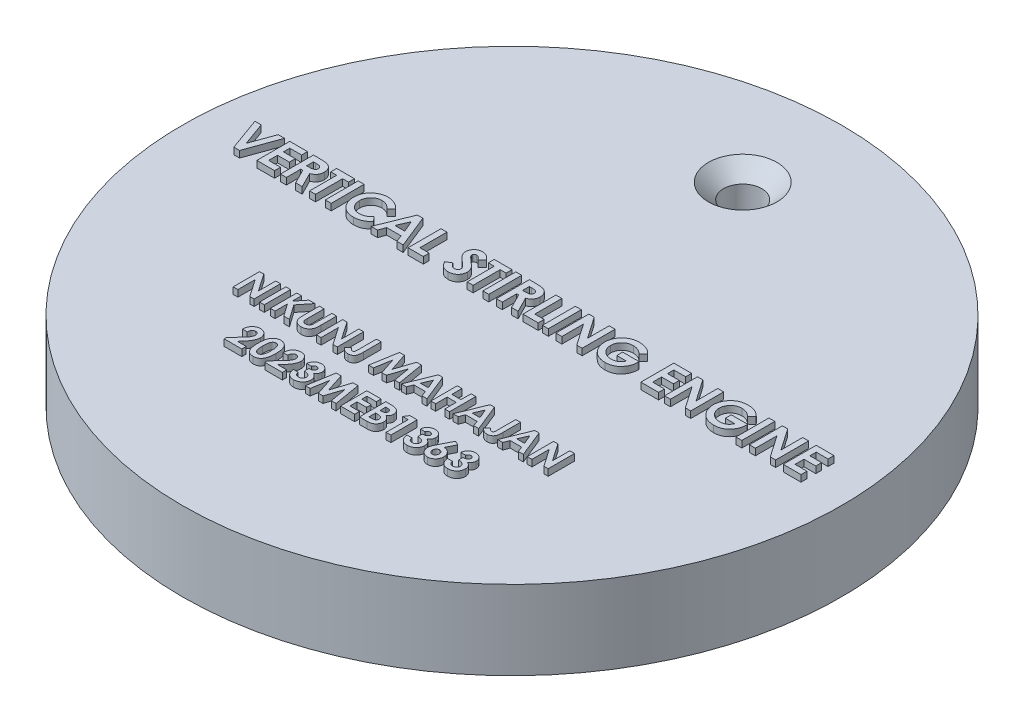
from build123d import *

# Parameters (mm, degrees)
SKETCH1_R           = 50
BOSS_EXTRUDE1_DEPTH = 12
SKETCH2_W           = 0.897435897
SKETCH2_H           = 5
SKETCH2_W_2         = 0.897435898
BOSS_EXTRUDE2_DEPTH = 1
SKETCH6_W           = 0.717948718
SKETCH6_H           = 4
BOSS_EXTRUDE5_DEPTH = 13


with BuildPart() as part:
    # Sketch1 → Boss-Extrude1 (new body)
    with BuildSketch(Plane(origin=(0, 0, 0), x_dir=(1, 0, 0), z_dir=(0, 1, 0))):
        with Locations(Location((0, 0, 0), (0, 0, 270))):
            Circle(SKETCH1_R)
    extrude(amount=BOSS_EXTRUDE1_DEPTH)

    # Sketch2 → Boss-Extrude2 (add)
    # profile 1 of 22: a face of its own
    with BuildSketch(Plane(origin=(0, 12, 0), x_dir=(1, 0, 0), z_dir=(0, 1, 0))):
        Polygon((-44.006410256, 5), (-43.047876603, 5), (-41.762820513, 1.448317308), (-40.476762821, 5), (-39.519230769, 5), (-41.331129808, 0), (-42.196514423, 0), align=None)
    # profile 2 of 22: a face of its own
    with BuildSketch(Plane(origin=(0, 12, 0), x_dir=(1, 0, 0), z_dir=(0, 1, 0))):
        Polygon((-38.717948718, 5), (-36.025641026, 5), (-36.025641026, 4.102564103), (-37.820512821, 4.102564103), (-37.820512821, 3.141025641), (-36.025641026, 3.141025641), (-36.025641026, 2.243589744), (-37.820512821, 2.243589744), (-37.820512821, 0.897435897), (-36.025641026, 0.897435897), (-36.025641026, 0), (-38.717948718, 0), align=None)
    # profile 3 of 22: a face of its own
    with BuildSketch(Plane(origin=(0, 12, 0), x_dir=(1, 0, 0), z_dir=(0, 1, 0))):
        with BuildLine():
            Line((-35.128205128, 5), (-34.082532051, 5))
            add(Edge.make_bspline(
                [(-34.082532051, 5), (-34.013413379, 4.999754668), (-33.880478703, 4.999282827), (-33.688794161, 4.991838413), (-33.512705548, 4.9814789), (-33.351952149, 4.965670008), (-33.206602737, 4.944709329), (-33.076511639, 4.920000156), (-32.961682656, 4.891838757), (-32.861147364, 4.856747431), (-32.770419235, 4.817164948), (-32.685848004, 4.771683948), (-32.605567906, 4.720810878), (-32.530115526, 4.66320713), (-32.458835165, 4.59990898), (-32.391592347, 4.530852713), (-32.329337278, 4.45545276), (-32.272455442, 4.374185553), (-32.220612227, 4.288694315), (-32.174793698, 4.198861665), (-32.137533994, 4.104625132), (-32.104611052, 4.007346636), (-32.080897723, 3.905635563), (-32.06440545, 3.800482087), (-32.052330453, 3.691516057), (-32.051636198, 3.617489374), (-32.051282051, 3.579727564)],
                knots=[0, 0, 0, 0, 1.749336639, 3.364467119, 4.854658419, 6.213483162, 7.451590619, 8.570285859, 9.5643256, 10.440900261, 11.26203566, 12.067320669, 12.869050712, 13.665104639, 14.467235401, 15.27997916, 16.102287765, 16.939272006, 17.78853747, 18.631303466, 19.488103222, 20.351255419, 21.228522269, 22.127379805, 23.044756219, 24, 24, 24, 24], degree=3))
            add(Edge.make_bspline(
                [(-32.051282051, 3.579727564), (-32.052201997, 3.540312909), (-32.054005844, 3.463027954), (-32.063722342, 3.349502658), (-32.081481047, 3.240889596), (-32.108379191, 3.137506773), (-32.139295114, 3.03806747), (-32.18040536, 2.944406403), (-32.226802336, 2.855161409), (-32.281906669, 2.771594891), (-32.342380983, 2.69185067), (-32.412711337, 2.618984044), (-32.488341406, 2.549078706), (-32.573522631, 2.48651329), (-32.664500145, 2.42705735), (-32.763081574, 2.373174433), (-32.868623543, 2.323510049), (-32.942824773, 2.295813758), (-32.980769231, 2.281650641)],
                knots=[0, 0, 0, 0, 1.099860209, 2.156625411, 3.176576793, 4.16617041, 5.135385252, 6.078461593, 7.016046972, 7.938469504, 8.868247731, 9.803980173, 10.76021508, 11.73834243, 12.748633912, 13.790971185, 14.870363756, 16, 16, 16, 16], degree=3))
            Line((-32.980769231, 2.281650641), (-31.826923077, 0))
            Line((-31.826923077, 0), (-32.824519231, 0))
            Line((-32.824519231, 0), (-33.926282051, 2.179487179))
            Line((-33.926282051, 2.179487179), (-34.230769231, 2.179487179))
            Line((-34.230769231, 2.179487179), (-34.230769231, 0))
            Line((-34.230769231, 0), (-35.128205128, 0))
            Line((-35.128205128, 0), (-35.128205128, 5))
        make_face()
        with BuildLine():
            Line((-34.230769231, 3.076923077), (-33.881209936, 3.076923077))
            add(Edge.make_bspline(
                [(-33.881209936, 3.076923077), (-33.838473406, 3.077404404), (-33.756642135, 3.078326043), (-33.63895802, 3.082600986), (-33.532072777, 3.092901485), (-33.435527405, 3.105915781), (-33.348836096, 3.120942666), (-33.272772107, 3.142477103), (-33.206163408, 3.165551798), (-33.149799314, 3.194227658), (-33.101643127, 3.22683833), (-33.060063342, 3.263884865), (-33.025670897, 3.306761511), (-32.997364162, 3.354303067), (-32.975344599, 3.406930027), (-32.959272005, 3.464064664), (-32.950289801, 3.526357817), (-32.949256368, 3.569348574), (-32.948717949, 3.591746795)],
                knots=[0, 0, 0, 0, 1.688639943, 3.233382647, 4.650958383, 5.928841754, 7.082724185, 8.122798841, 9.049171256, 9.863274652, 10.613301712, 11.341792392, 12.054588806, 12.776240173, 13.521029143, 14.301969904, 15.115324896, 16, 16, 16, 16], degree=3))
            add(Edge.make_bspline(
                [(-32.948717949, 3.591746795), (-32.94973588, 3.618245525), (-32.951735418, 3.67029737), (-32.971577043, 3.745233775), (-33.003160624, 3.814592545), (-33.046453063, 3.8780603), (-33.100974261, 3.933700515), (-33.163541638, 3.982747808), (-33.235505548, 4.021530737), (-33.302138714, 4.047111544), (-33.362759319, 4.062416805), (-33.417467503, 4.07382215), (-33.48081991, 4.081905445), (-33.552864367, 4.090479219), (-33.63341723, 4.096038877), (-33.72291756, 4.100096319), (-33.821108314, 4.101756418), (-33.889556595, 4.102287123), (-33.925280449, 4.102564103)],
                knots=[0, 0, 0, 0, 1.020303359, 2.004196876, 2.966617323, 3.9489082, 4.950758222, 5.960522915, 7.003732012, 8.091992268, 8.70421221, 9.413913587, 10.24622431, 11.166358409, 12.212345909, 13.359657661, 14.621978493, 16, 16, 16, 16], degree=3))
            Line((-33.925280449, 4.102564103), (-34.230769231, 4.102564103))
            Line((-34.230769231, 4.102564103), (-34.230769231, 3.076923077))
        make_face(mode=Mode.SUBTRACT)
    # profile 4 of 22: a face of its own
    with BuildSketch(Plane(origin=(0, 12, 0), x_dir=(1, 0, 0), z_dir=(0, 1, 0))):
        Polygon((-31.602564103, 5), (-28.91025641, 5), (-28.91025641, 4.102564103), (-29.807692308, 4.102564103), (-29.807692308, 0), (-30.705128205, 0), (-30.705128205, 4.102564103), (-31.602564103, 4.102564103), align=None)
    # profile 5 of 22: a face of its own
    with BuildSketch(Plane(origin=(0, 12, 0), x_dir=(1, 0, 0), z_dir=(0, 1, 0))):
        with Locations((-27.884615385, 2.5)):
            Rectangle(SKETCH2_W, SKETCH2_H)
    # profile 6 of 22: a face of its own
    with BuildSketch(Plane(origin=(0, 12, 0), x_dir=(1, 0, 0), z_dir=(0, 1, 0))):
        with BuildLine():
            Line((-21.794871795, 4.132612179), (-22.452924679, 3.503605769))
            add(Edge.make_bspline(
                [(-22.452924679, 3.503605769), (-22.508746086, 3.561325197), (-22.617782782, 3.674069323), (-22.793481932, 3.82333261), (-22.97620265, 3.947723364), (-23.162390471, 4.052484465), (-23.355394372, 4.131743704), (-23.552982704, 4.189501246), (-23.756417126, 4.224713837), (-23.894093718, 4.22874278), (-23.963341346, 4.230769231)],
                knots=[0, 0, 0, 0, 1.115251505, 2.178435587, 3.19620269, 4.182487026, 5.141301733, 6.088180966, 7.038406374, 8, 8, 8, 8], degree=3))
            add(Edge.make_bspline(
                [(-23.963341346, 4.230769231), (-24.021171531, 4.229168264), (-24.135293029, 4.226008933), (-24.302853293, 4.202847918), (-24.463133345, 4.163461605), (-24.61668185, 4.10917997), (-24.763046984, 4.038942415), (-24.902535619, 3.952803302), (-25.034803853, 3.85154059), (-25.158104499, 3.735678217), (-25.270895596, 3.609089868), (-25.370553713, 3.474020401), (-25.454033371, 3.330779254), (-25.522543769, 3.180817067), (-25.575910721, 3.02343974), (-25.614021429, 2.858753228), (-25.636063644, 2.6865614), (-25.639353592, 2.569506679), (-25.641025641, 2.510016026)],
                knots=[0, 0, 0, 0, 1.035432265, 2.043311493, 3.022114605, 3.98653278, 4.95457646, 5.923598177, 6.917315552, 7.932509744, 8.948865224, 9.949768934, 10.933144597, 11.912367597, 12.897413939, 13.903909035, 14.934704909, 16, 16, 16, 16], degree=3))
            add(Edge.make_bspline(
                [(-25.641025641, 2.510016026), (-25.640543776, 2.468261323), (-25.639594009, 2.385961946), (-25.629197136, 2.264218326), (-25.612455718, 2.146098234), (-25.588226739, 2.031780589), (-25.557928163, 1.921166322), (-25.522381034, 1.813301171), (-25.477787683, 1.709675588), (-25.428288391, 1.609086031), (-25.370721285, 1.51427721), (-25.308653324, 1.423869131), (-25.241350755, 1.338304964), (-25.168377654, 1.2579345), (-25.088707016, 1.184013749), (-25.004398031, 1.114319825), (-24.914028525, 1.050597403), (-24.8194757, 0.991247299), (-24.71992274, 0.93968936), (-24.618070748, 0.892987827), (-24.512375441, 0.855059238), (-24.404123724, 0.824485336), (-24.29370245, 0.798486798), (-24.180031597, 0.7824787), (-24.064096548, 0.770355954), (-23.985743915, 0.769607445), (-23.946314103, 0.769230769)],
                knots=[0, 0, 0, 0, 1.103660481, 2.175337485, 3.227646561, 4.255952547, 5.262355991, 6.258840057, 7.255597736, 8.242457506, 9.22035537, 10.185017736, 11.140346927, 12.096287581, 13.051739095, 14.01125915, 14.986044842, 15.97314143, 16.960198552, 17.947847494, 18.933482797, 19.925264591, 20.920966487, 21.929612487, 22.958107872, 24, 24, 24, 24], degree=3))
            add(Edge.make_bspline(
                [(-23.946314103, 0.769230769), (-23.879434364, 0.771165286), (-23.748033069, 0.774966109), (-23.555182775, 0.804688005), (-23.371415658, 0.853578841), (-23.224586611, 0.911316078), (-23.10954993, 0.96833235), (-23.021974206, 1.021069593), (-22.931414082, 1.080061989), (-22.839373683, 1.147535976), (-22.744817739, 1.222681839), (-22.649415379, 1.307145412), (-22.550724286, 1.398145431), (-22.48607273, 1.463093932), (-22.452924679, 1.496394231)],
                knots=[0, 0, 0, 0, 1.404581149, 2.759636711, 4.088442092, 5.392261763, 6.066678138, 6.783632037, 7.538459478, 8.336747902, 9.180226004, 10.074962426, 11.012997595, 12, 12, 12, 12], degree=3))
            Line((-22.452924679, 1.496394231), (-21.814903846, 0.826322115))
            add(Edge.make_bspline(
                [(-21.814903846, 0.826322115), (-21.859753277, 0.783021398), (-21.947289773, 0.698507659), (-22.079336149, 0.578506035), (-22.211216338, 0.470671236), (-22.339744392, 0.371089331), (-22.467025732, 0.282661384), (-22.593046863, 0.205299079), (-22.716381168, 0.137045812), (-22.839589724, 0.079052641), (-22.9634392, 0.029810416), (-23.090865756, -0.012583908), (-23.222258947, -0.04844798), (-23.358421263, -0.077385577), (-23.498082666, -0.100589623), (-23.642550199, -0.116252219), (-23.790907869, -0.126781662), (-23.891541174, -0.12772782), (-23.942307692, -0.128205128)],
                knots=[0, 0, 0, 0, 1.244526981, 2.429050516, 3.560637417, 4.644440555, 5.67424972, 6.652764056, 7.595344123, 8.486817594, 9.369275933, 10.254498637, 11.166417451, 12.086725134, 13.032340136, 13.991389299, 14.986715468, 16, 16, 16, 16], degree=3))
            add(Edge.make_bspline(
                [(-23.942307692, -0.128205128), (-24.035559498, -0.125827954), (-24.218027361, -0.121176484), (-24.485429256, -0.086712243), (-24.739453878, -0.028933549), (-24.980719222, 0.05278146), (-25.209148571, 0.157168554), (-25.424683486, 0.28514223), (-25.626976572, 0.436362482), (-25.814393699, 0.609056861), (-25.98392141, 0.799783306), (-26.133764275, 1.004571183), (-26.257714298, 1.224426951), (-26.360632673, 1.456102637), (-26.441113489, 1.700655468), (-26.497758339, 1.958349975), (-26.532690805, 2.228937338), (-26.536512466, 2.413754744), (-26.538461538, 2.508012821)],
                knots=[0, 0, 0, 0, 1.078019885, 2.10938526, 3.111377082, 4.085535484, 5.04941344, 6.010039228, 6.978205633, 7.964457913, 8.951525778, 9.924444315, 10.892603023, 11.863865945, 12.85144698, 13.863884204, 14.910567087, 16, 16, 16, 16], degree=3))
            add(Edge.make_bspline(
                [(-26.538461538, 2.508012821), (-26.537637955, 2.569487134), (-26.536005814, 2.691314197), (-26.518851861, 2.870775332), (-26.494938252, 3.045717838), (-26.457001487, 3.214325232), (-26.411272458, 3.378868967), (-26.354402402, 3.537560644), (-26.286482149, 3.690856359), (-26.209700928, 3.839012739), (-26.122839102, 3.9810592), (-26.025804906, 4.115775339), (-25.921096379, 4.244201141), (-25.806197546, 4.364632798), (-25.682778037, 4.478127724), (-25.550280628, 4.584070869), (-25.409502225, 4.683981576), (-25.260061791, 4.77528339), (-25.104862558, 4.857870734), (-24.945861996, 4.930716299), (-24.783450749, 4.991598416), (-24.618315509, 5.042097887), (-24.449758581, 5.07979217), (-24.278983081, 5.108325527), (-24.104535915, 5.124275856), (-23.987409756, 5.126887027), (-23.928285256, 5.128205128)],
                knots=[0, 0, 0, 0, 1.071919942, 2.124283339, 3.142214191, 4.149696895, 5.136002878, 6.119640489, 7.086990633, 8.058538607, 9.028339693, 9.988281803, 10.952401235, 11.916291999, 12.888973767, 13.874849856, 14.873389453, 15.898127285, 16.927174885, 17.938320013, 18.946391617, 19.950418109, 20.947802303, 21.956882652, 22.968648068, 24, 24, 24, 24], degree=3))
            add(Edge.make_bspline(
                [(-23.928285256, 5.128205128), (-23.877845996, 5.12744956), (-23.777491903, 5.125946278), (-23.628047819, 5.113414792), (-23.479798919, 5.093734219), (-23.333275979, 5.064040426), (-23.187430917, 5.028790142), (-23.044180302, 4.982634756), (-22.901264276, 4.931185881), (-22.760924267, 4.869689256), (-22.622964379, 4.802560135), (-22.49061654, 4.72639971), (-22.361658643, 4.645894807), (-22.238948317, 4.556280794), (-22.120186933, 4.460808139), (-22.005995505, 4.359031406), (-21.897376129, 4.24925368), (-21.82921264, 4.171689237), (-21.794871795, 4.132612179)],
                knots=[0, 0, 0, 0, 0.996412454, 1.982464992, 2.961075852, 3.949442424, 4.934965278, 5.923860011, 6.921385422, 7.934793307, 8.949617135, 9.951082467, 10.950285876, 11.951772932, 12.951063433, 13.960125323, 14.972308753, 16, 16, 16, 16], degree=3))
        make_face()
    # profile 7 of 22: a face of its own
    with BuildSketch(Plane(origin=(0, 12, 0), x_dir=(1, 0, 0), z_dir=(0, 1, 0))):
        Polygon((-19.359975962, 5), (-18.525641026, 5), (-16.506410256, 0), (-17.46494391, 0), (-17.853565705, 1.025641026), (-20.030048077, 1.025641026), (-20.419671474, 0), (-21.378205128, 0), align=None)
        Polygon((-18.942307692, 3.658854167), (-19.689503205, 1.923076923), (-18.194110577, 1.923076923), align=None, mode=Mode.SUBTRACT)
    # profile 8 of 22: a face of its own
    with BuildSketch(Plane(origin=(0, 12, 0), x_dir=(1, 0, 0), z_dir=(0, 1, 0))):
        Polygon((-15.769230769, 5), (-14.871794872, 5), (-14.871794872, 0.897435897), (-13.461538462, 0.897435897), (-13.461538462, 0), (-15.769230769, 0), align=None)
    # profile 9 of 22: a face of its own
    with BuildSketch(Plane(origin=(0, 12, 0), x_dir=(1, 0, 0), z_dir=(0, 1, 0))):
        with BuildLine():
            Line((-8.205128205, 4.33193109), (-8.876201923, 3.717948718))
            add(Edge.make_bspline(
                [(-8.876201923, 3.717948718), (-8.904947844, 3.758497827), (-8.960136002, 3.836346463), (-9.049590251, 3.94058762), (-9.138640569, 4.029513085), (-9.228111951, 4.102751368), (-9.318797439, 4.159857492), (-9.410539616, 4.200289258), (-9.50281837, 4.225992116), (-9.564815447, 4.22919274), (-9.595352564, 4.230769231)],
                knots=[0, 0, 0, 0, 1.299362458, 2.494594718, 3.587462134, 4.587049575, 5.512617175, 6.380583204, 7.202344345, 8, 8, 8, 8], degree=3))
            add(Edge.make_bspline(
                [(-9.595352564, 4.230769231), (-9.623836711, 4.229770294), (-9.678832114, 4.227841609), (-9.757232141, 4.208670625), (-9.826836802, 4.175584321), (-9.887578166, 4.132321196), (-9.935694287, 4.080199161), (-9.974111279, 4.025536547), (-9.995743273, 3.965201384), (-9.998590469, 3.923760759), (-10, 3.903245192)],
                knots=[0, 0, 0, 0, 1.185010067, 2.2879431, 3.333075148, 4.379039566, 5.372662701, 6.27520591, 7.14612461, 8, 8, 8, 8], degree=3))
            add(Edge.make_bspline(
                [(-10, 3.903245192), (-9.999116718, 3.882433782), (-9.997337912, 3.840522492), (-9.980157064, 3.779096278), (-9.954260619, 3.719075717), (-9.92951551, 3.682538345), (-9.916866987, 3.663862179)],
                knots=[0, 0, 0, 0, 0.967525499, 1.948461899, 2.951351359, 4, 4, 4, 4], degree=3))
            add(Edge.make_bspline(
                [(-9.916866987, 3.663862179), (-9.905368112, 3.649345391), (-9.87889922, 3.615929662), (-9.828428464, 3.563004356), (-9.765047794, 3.498166224), (-9.686318189, 3.423644859), (-9.595507931, 3.33676018), (-9.488407847, 3.240927659), (-9.368100745, 3.133179473), (-9.282589245, 3.058147537), (-9.237780449, 3.018830128)],
                knots=[0, 0, 0, 0, 0.473873513, 1.090794244, 1.870441696, 2.795289791, 3.865433203, 5.087734844, 6.473946851, 8, 8, 8, 8], degree=3))
            add(Edge.make_bspline(
                [(-9.237780449, 3.018830128), (-9.195720948, 2.982429752), (-9.115900754, 2.9133494), (-9.002332469, 2.815300932), (-8.90252486, 2.727089116), (-8.81502396, 2.650037823), (-8.741156196, 2.583338608), (-8.680611028, 2.52667265), (-8.632649, 2.48114313), (-8.605385395, 2.453643273), (-8.59375, 2.441907051)],
                knots=[0, 0, 0, 0, 1.543621617, 2.929473131, 4.163658386, 5.240097082, 6.164993805, 6.925417477, 7.541396219, 8, 8, 8, 8], degree=3))
            add(Edge.make_bspline(
                [(-8.59375, 2.441907051), (-8.549607736, 2.394135668), (-8.464750804, 2.302302294), (-8.354466706, 2.159989444), (-8.263699325, 2.021063084), (-8.193479959, 1.88290909), (-8.140447469, 1.743534174), (-8.103058861, 1.599520174), (-8.080666575, 1.449362234), (-8.078180508, 1.34689777), (-8.076923077, 1.295072115)],
                knots=[0, 0, 0, 0, 1.206664779, 2.319633467, 3.337109185, 4.282041471, 5.190008762, 6.099243693, 7.03861361, 8, 8, 8, 8], degree=3))
            add(Edge.make_bspline(
                [(-8.076923077, 1.295072115), (-8.077818084, 1.24457437), (-8.079574122, 1.145495916), (-8.101082219, 1.000509355), (-8.131751502, 0.861750924), (-8.179171595, 0.730730511), (-8.236966923, 0.605297455), (-8.309421714, 0.487405604), (-8.394509931, 0.375861845), (-8.492034092, 0.27266016), (-8.599907395, 0.179011783), (-8.715611764, 0.095643786), (-8.840278615, 0.026812885), (-8.972842815, -0.029864452), (-9.113233404, -0.073518094), (-9.261283135, -0.105782205), (-9.417218461, -0.125146615), (-9.523849283, -0.127170935), (-9.578325321, -0.128205128)],
                knots=[0, 0, 0, 0, 1.043214005, 2.046824704, 3.02475056, 3.976699089, 4.921714032, 5.875962561, 6.831408892, 7.817874052, 8.806269674, 9.781291748, 10.760897367, 11.74438705, 12.757449933, 13.795994037, 14.874007457, 16, 16, 16, 16], degree=3))
            add(Edge.make_bspline(
                [(-9.578325321, -0.128205128), (-9.621088546, -0.12744648), (-9.705784257, -0.125943922), (-9.83061293, -0.113676784), (-9.951149126, -0.093878928), (-10.06725707, -0.065502686), (-10.179459849, -0.02954614), (-10.287762072, 0.014373404), (-10.391416092, 0.066936683), (-10.491206205, 0.127062785), (-10.586647307, 0.19687711), (-10.678946214, 0.274952327), (-10.767186126, 0.362489267), (-10.85179084, 0.459280908), (-10.932219032, 0.565601343), (-11.011103406, 0.67996986), (-11.084938103, 0.804508986), (-11.13054908, 0.89187419), (-11.153846154, 0.936498397)],
                knots=[0, 0, 0, 0, 1.016823716, 2.013894106, 2.979844003, 3.91962641, 4.853723003, 5.779685073, 6.695824784, 7.614987388, 8.547259901, 9.504950863, 10.487499108, 11.500346958, 12.559593716, 13.656357062, 14.802919212, 16, 16, 16, 16], degree=3))
            Line((-11.153846154, 0.936498397), (-10.364583333, 1.41025641))
            add(Edge.make_bspline(
                [(-10.364583333, 1.41025641), (-10.335442175, 1.359602105), (-10.279576085, 1.262493472), (-10.184905772, 1.132015716), (-10.087920869, 1.020283117), (-9.986379172, 0.929270554), (-9.881515391, 0.857761073), (-9.772823009, 0.806655436), (-9.660225661, 0.775021105), (-9.583529462, 0.771157823), (-9.545272436, 0.769230769)],
                knots=[0, 0, 0, 0, 1.283663364, 2.460892379, 3.537111102, 4.529833553, 5.449777664, 6.316464042, 7.160231139, 8, 8, 8, 8], degree=3))
            add(Edge.make_bspline(
                [(-9.545272436, 0.769230769), (-9.506359563, 0.770804506), (-9.430862923, 0.773857784), (-9.323101129, 0.802059994), (-9.224301037, 0.846339533), (-9.138898966, 0.909520329), (-9.066585878, 0.982440571), (-9.013214668, 1.063567673), (-8.979686514, 1.15134524), (-8.976141775, 1.212321312), (-8.974358974, 1.242988782)],
                knots=[0, 0, 0, 0, 1.13588714, 2.203786484, 3.234766741, 4.283437687, 5.291419208, 6.222934724, 7.106237994, 8, 8, 8, 8], degree=3))
            add(Edge.make_bspline(
                [(-8.974358974, 1.242988782), (-8.976005318, 1.271519872), (-8.979349706, 1.329478051), (-9.003983443, 1.415652543), (-9.042493488, 1.501787845), (-9.088053586, 1.57243835), (-9.134416691, 1.631592103), (-9.178750276, 1.682846153), (-9.232736856, 1.739472906), (-9.296239543, 1.801543594), (-9.368419302, 1.86960464), (-9.449336934, 1.94364938), (-9.539919033, 2.023025568), (-9.603942639, 2.077095843), (-9.637419872, 2.10536859)],
                knots=[0, 0, 0, 0, 0.916159276, 1.861089862, 2.860218735, 3.940849679, 4.552606315, 5.27541173, 6.11797699, 7.06649574, 8.129236253, 9.306560635, 10.591630461, 12, 12, 12, 12], degree=3))
            add(Edge.make_bspline(
                [(-9.637419872, 2.10536859), (-9.701061424, 2.159215445), (-9.823208825, 2.26256386), (-9.9958186, 2.415206214), (-10.151355462, 2.557864481), (-10.288476029, 2.692302228), (-10.408927428, 2.816036702), (-10.51189391, 2.930072921), (-10.596244341, 3.035290519), (-10.685004982, 3.159913723), (-10.769345338, 3.31177566), (-10.842239339, 3.494483175), (-10.88952989, 3.677167507), (-10.894828138, 3.799811705), (-10.897435897, 3.860176282)],
                knots=[0, 0, 0, 0, 1.345494975, 2.582412109, 3.71882943, 4.751509156, 5.681369928, 6.505683931, 7.230279997, 7.856715994, 8.973648664, 10.023341002, 11.027102913, 12, 12, 12, 12], degree=3))
            add(Edge.make_bspline(
                [(-10.897435897, 3.860176282), (-10.896351334, 3.9029836), (-10.894214627, 3.987318614), (-10.875154874, 4.111320964), (-10.846669346, 4.230972813), (-10.805300183, 4.345837616), (-10.751608003, 4.455771501), (-10.686400936, 4.56131264), (-10.608666441, 4.661489655), (-10.521064912, 4.756236138), (-10.424550456, 4.842823641), (-10.321412494, 4.919245789), (-10.212234797, 4.983793046), (-10.097685259, 5.037339683), (-9.977054062, 5.078326232), (-9.851229893, 5.10737954), (-9.720032279, 5.124659522), (-9.630794494, 5.127008535), (-9.585336538, 5.128205128)],
                knots=[0, 0, 0, 0, 1.010766082, 1.991317756, 2.957454644, 3.913069143, 4.869106762, 5.843196583, 6.838735724, 7.860187025, 8.887984031, 9.89767229, 10.887916223, 11.879572884, 12.879850636, 13.892031539, 14.926195476, 16, 16, 16, 16], degree=3))
            add(Edge.make_bspline(
                [(-9.585336538, 5.128205128), (-9.526425278, 5.126050029), (-9.409067781, 5.121756841), (-9.235551337, 5.08818552), (-9.066067729, 5.035391081), (-8.929494661, 4.971700398), (-8.820826021, 4.910003203), (-8.737541659, 4.853200198), (-8.652795338, 4.788129303), (-8.565903631, 4.714585463), (-8.478481121, 4.631183014), (-8.388041967, 4.539907417), (-8.295818515, 4.439969839), (-8.235887893, 4.368574896), (-8.205128205, 4.33193109)],
                knots=[0, 0, 0, 0, 1.282922637, 2.555718331, 3.837320111, 5.142675274, 5.830281639, 6.55870424, 7.337177975, 8.157850921, 9.037902056, 9.96903443, 10.957596896, 12, 12, 12, 12], degree=3))
        make_face()
    # profile 10 of 22: a face of its own
    with BuildSketch(Plane(origin=(0, 12, 0), x_dir=(1, 0, 0), z_dir=(0, 1, 0))):
        Polygon((-7.692307692, 5), (-5, 5), (-5, 4.102564103), (-5.897435897, 4.102564103), (-5.897435897, 0), (-6.794871795, 0), (-6.794871795, 4.102564103), (-7.692307692, 4.102564103), align=None)
    # profile 11 of 22: a face of its own
    with BuildSketch(Plane(origin=(0, 12, 0), x_dir=(1, 0, 0), z_dir=(0, 1, 0))):
        with Locations((-3.974358975, 2.5)):
            Rectangle(SKETCH2_W, SKETCH2_H)
    # profile 12 of 22: a face of its own
    with BuildSketch(Plane(origin=(0, 12, 0), x_dir=(1, 0, 0), z_dir=(0, 1, 0))):
        with BuildLine():
            Line((-2.371794872, 5), (-1.326121795, 5))
            add(Edge.make_bspline(
                [(-1.326121795, 5), (-1.257003123, 4.999754668), (-1.124068447, 4.999282827), (-0.932383904, 4.991838413), (-0.756295292, 4.9814789), (-0.595541893, 4.965670008), (-0.450192481, 4.944709329), (-0.320101382, 4.920000156), (-0.205272399, 4.891838757), (-0.104737107, 4.856747431), (-0.014008978, 4.817164948), (0.070562252, 4.771683948), (0.15084235, 4.720810878), (0.22629473, 4.66320713), (0.297575092, 4.59990898), (0.364817909, 4.530852713), (0.427072979, 4.45545276), (0.483954815, 4.374185553), (0.53579803, 4.288694315), (0.581616558, 4.198861665), (0.618876262, 4.104625132), (0.651799204, 4.007346636), (0.675512533, 3.905635563), (0.692004806, 3.800482087), (0.704079804, 3.691516057), (0.704774058, 3.617489374), (0.705128205, 3.579727564)],
                knots=[0, 0, 0, 0, 1.749336639, 3.364467119, 4.854658419, 6.213483162, 7.451590619, 8.570285859, 9.5643256, 10.440900261, 11.26203566, 12.067320669, 12.869050712, 13.665104639, 14.467235401, 15.27997916, 16.102287765, 16.939272006, 17.78853747, 18.631303466, 19.488103222, 20.351255419, 21.228522269, 22.127379805, 23.044756219, 24, 24, 24, 24], degree=3))
            add(Edge.make_bspline(
                [(0.705128205, 3.579727564), (0.704208259, 3.540312909), (0.702404413, 3.463027954), (0.692687915, 3.349502658), (0.674929209, 3.240889596), (0.648031065, 3.137506773), (0.617115143, 3.03806747), (0.576004896, 2.944406403), (0.52960792, 2.855161409), (0.474503587, 2.771594891), (0.414029274, 2.69185067), (0.343698919, 2.618984044), (0.26806885, 2.549078706), (0.182887625, 2.48651329), (0.091910112, 2.42705735), (-0.006671317, 2.373174433), (-0.112213286, 2.323510049), (-0.186414517, 2.295813758), (-0.224358974, 2.281650641)],
                knots=[0, 0, 0, 0, 1.099860209, 2.156625411, 3.176576793, 4.16617041, 5.135385252, 6.078461593, 7.016046972, 7.938469504, 8.868247731, 9.803980173, 10.76021508, 11.73834243, 12.748633912, 13.790971185, 14.870363756, 16, 16, 16, 16], degree=3))
            Line((-0.224358974, 2.281650641), (0.929487179, 0))
            Line((0.929487179, 0), (-0.068108974, 0))
            Line((-0.068108974, 0), (-1.169871795, 2.179487179))
            Line((-1.169871795, 2.179487179), (-1.474358974, 2.179487179))
            Line((-1.474358974, 2.179487179), (-1.474358974, 0))
            Line((-1.474358974, 0), (-2.371794872, 0))
            Line((-2.371794872, 0), (-2.371794872, 5))
        make_face()
        with BuildLine():
            Line((-1.474358974, 3.076923077), (-1.124799679, 3.076923077))
            add(Edge.make_bspline(
                [(-1.124799679, 3.076923077), (-1.08206315, 3.077404404), (-1.000231879, 3.078326043), (-0.882547763, 3.082600986), (-0.77566252, 3.092901485), (-0.679117148, 3.105915781), (-0.59242584, 3.120942666), (-0.516361851, 3.142477103), (-0.449753152, 3.165551798), (-0.393389057, 3.194227658), (-0.34523287, 3.22683833), (-0.303653085, 3.263884865), (-0.269260641, 3.306761511), (-0.240953905, 3.354303067), (-0.218934342, 3.406930027), (-0.202861748, 3.464064664), (-0.193879545, 3.526357817), (-0.192846112, 3.569348574), (-0.192307692, 3.591746795)],
                knots=[0, 0, 0, 0, 1.688639943, 3.233382647, 4.650958383, 5.928841754, 7.082724185, 8.122798841, 9.049171256, 9.863274652, 10.613301712, 11.341792392, 12.054588806, 12.776240173, 13.521029143, 14.301969904, 15.115324896, 16, 16, 16, 16], degree=3))
            add(Edge.make_bspline(
                [(-0.192307692, 3.591746795), (-0.193325624, 3.618245525), (-0.195325161, 3.67029737), (-0.215166786, 3.745233775), (-0.246750367, 3.814592545), (-0.290042806, 3.8780603), (-0.344564005, 3.933700515), (-0.407131382, 3.982747808), (-0.479095292, 4.021530737), (-0.545728457, 4.047111544), (-0.606349063, 4.062416805), (-0.661057247, 4.07382215), (-0.724409654, 4.081905445), (-0.79645411, 4.090479219), (-0.877006973, 4.096038877), (-0.966507304, 4.100096319), (-1.064698057, 4.101756418), (-1.133146339, 4.102287123), (-1.168870192, 4.102564103)],
                knots=[0, 0, 0, 0, 1.020303359, 2.004196876, 2.966617323, 3.9489082, 4.950758222, 5.960522915, 7.003732012, 8.091992268, 8.70421221, 9.413913587, 10.24622431, 11.166358409, 12.212345909, 13.359657661, 14.621978493, 16, 16, 16, 16], degree=3))
            Line((-1.168870192, 4.102564103), (-1.474358974, 4.102564103))
            Line((-1.474358974, 4.102564103), (-1.474358974, 3.076923077))
        make_face(mode=Mode.SUBTRACT)
    # profile 13 of 22: a face of its own
    with BuildSketch(Plane(origin=(0, 12, 0), x_dir=(1, 0, 0), z_dir=(0, 1, 0))):
        Polygon((1.666666667, 5), (2.564102564, 5), (2.564102564, 0.897435897), (3.974358974, 0.897435897), (3.974358974, 0), (1.666666667, 0), align=None)
    # profile 14 of 22: a face of its own
    with BuildSketch(Plane(origin=(0, 12, 0), x_dir=(1, 0, 0), z_dir=(0, 1, 0))):
        with Locations((5.064102564, 2.5)):
            Rectangle(SKETCH2_W_2, SKETCH2_H)
    # profile 15 of 22: a face of its own
    with BuildSketch(Plane(origin=(0, 12, 0), x_dir=(1, 0, 0), z_dir=(0, 1, 0))):
        Polygon((6.666666667, 5), (7.474959936, 5), (9.743589744, 1.709735577), (9.743589744, 5), (10.641025641, 5), (10.641025641, 0), (9.826722756, 0), (7.564102564, 3.280248397), (7.564102564, 0), (6.666666667, 0), align=None)
    # profile 16 of 22: a face of its own
    with BuildSketch(Plane(origin=(0, 12, 0), x_dir=(1, 0, 0), z_dir=(0, 1, 0))):
        with BuildLine():
            Line((16.377203526, 4.204727564), (15.698116987, 3.5546875))
            add(Edge.make_bspline(
                [(15.698116987, 3.5546875), (15.644352521, 3.608516386), (15.538857762, 3.714137546), (15.366334281, 3.851610745), (15.187652313, 3.968490141), (15.002223746, 4.064596556), (14.809790276, 4.139145047), (14.610731656, 4.192471968), (14.404724044, 4.224101068), (14.265266086, 4.228529035), (14.194711538, 4.230769231)],
                knots=[0, 0, 0, 0, 1.075575784, 2.110457258, 3.113929901, 4.09197124, 5.059417775, 6.02750972, 7.002078037, 8, 8, 8, 8], degree=3))
            add(Edge.make_bspline(
                [(14.194711538, 4.230769231), (14.133542903, 4.229199536), (14.013432925, 4.226117301), (13.83694288, 4.202711026), (13.668295832, 4.163611896), (13.506695021, 4.10944658), (13.353127076, 4.038960384), (13.206702197, 3.953241181), (13.068321484, 3.85163321), (12.939074584, 3.736062606), (12.821394865, 3.609882841), (12.718654257, 3.474825875), (12.631141331, 3.333409054), (12.559100345, 3.184908869), (12.504284989, 3.02955324), (12.465153998, 2.867454946), (12.440315549, 2.699085066), (12.43738287, 2.584221391), (12.435897436, 2.526041667)],
                knots=[0, 0, 0, 0, 1.075001177, 2.110859044, 3.123021556, 4.114053297, 5.101481495, 6.087880186, 7.091499647, 8.114004866, 9.131394192, 10.11971144, 11.092043119, 12.050101265, 13.015322563, 13.981809771, 14.977764287, 16, 16, 16, 16], degree=3))
            add(Edge.make_bspline(
                [(12.435897436, 2.526041667), (12.437282978, 2.465848264), (12.440012686, 2.347259021), (12.466234613, 2.173224208), (12.506634006, 2.005790177), (12.565767946, 1.84619925), (12.638543918, 1.692265253), (12.730835841, 1.546970035), (12.838457458, 1.408094779), (12.961216465, 1.278057382), (13.094746563, 1.158194197), (13.239364004, 1.054797128), (13.390668639, 0.965587777), (13.55110253, 0.894936855), (13.717881022, 0.838211904), (13.892695726, 0.798215946), (14.075153002, 0.773678564), (14.199641956, 0.770728126), (14.262820513, 0.769230769)],
                knots=[0, 0, 0, 0, 1.022067601, 2.013613092, 2.983553406, 3.943623673, 4.90013463, 5.87121881, 6.861774014, 7.881098904, 8.905697761, 9.905387765, 10.89678721, 11.884561068, 12.87834324, 13.885584958, 14.926927371, 16, 16, 16, 16], degree=3))
            add(Edge.make_bspline(
                [(14.262820513, 0.769230769), (14.303915824, 0.769601565), (14.384595064, 0.77032952), (14.50293776, 0.782146274), (14.616281638, 0.799039698), (14.725065648, 0.821404584), (14.828191363, 0.853054912), (14.927086629, 0.890066073), (15.021172007, 0.933746623), (15.109937376, 0.985603622), (15.194703822, 1.043728979), (15.274677914, 1.110236748), (15.351262493, 1.183627423), (15.423562677, 1.264797576), (15.490354765, 1.354472963), (15.553778605, 1.45100568), (15.613108006, 1.555353755), (15.648164184, 1.629039079), (15.666065705, 1.666666667)],
                knots=[0, 0, 0, 0, 1.109579412, 2.178351274, 3.208885622, 4.204702371, 5.174744997, 6.119429583, 7.05542196, 7.97267548, 8.893247984, 9.828544973, 10.778894627, 11.756245826, 12.760884819, 13.796418446, 14.874735809, 16, 16, 16, 16], degree=3))
            Line((15.666065705, 1.666666667), (14.230769231, 1.666666667))
            Line((14.230769231, 1.666666667), (14.230769231, 2.564102564))
            Line((14.230769231, 2.564102564), (16.723758013, 2.564102564))
            Line((16.723758013, 2.564102564), (16.730769231, 2.350761218))
            add(Edge.make_bspline(
                [(16.730769231, 2.350761218), (16.729868341, 2.295969747), (16.728068171, 2.186484586), (16.711616496, 2.023479832), (16.684364548, 1.862636998), (16.647108527, 1.704117631), (16.600417307, 1.547144136), (16.540871387, 1.393219665), (16.471143477, 1.241300354), (16.393018302, 1.092031742), (16.305228083, 0.94880445), (16.210709022, 0.813187111), (16.110808553, 0.685414451), (16.00335388, 0.567266662), (15.890018252, 0.45775125), (15.770578564, 0.357289535), (15.644612365, 0.265796513), (15.512786949, 0.182499278), (15.374351442, 0.109494167), (15.230066963, 0.045989404), (15.080151361, -0.007943849), (14.92421759, -0.052157385), (14.762572488, -0.086271645), (14.595212592, -0.109663837), (14.422045988, -0.125559095), (14.304590743, -0.127312454), (14.244791667, -0.128205128)],
                knots=[0, 0, 0, 0, 1.006889344, 2.011981806, 3.007738725, 4.003571281, 5.003404394, 6.015442001, 7.03424805, 8.074616296, 9.110249922, 10.119753985, 11.111721717, 12.089233633, 13.052717867, 14.006597561, 14.955430184, 15.912305663, 16.870361111, 17.829300583, 18.807640451, 19.796414044, 20.806216501, 21.841577364, 22.90109906, 24, 24, 24, 24], degree=3))
            add(Edge.make_bspline(
                [(14.244791667, -0.128205128), (14.180990107, -0.127323596), (14.054516386, -0.125576137), (13.867508039, -0.109209988), (13.68592492, -0.082198717), (13.509721739, -0.04481604), (13.338489387, 0.001709687), (13.172522068, 0.06011048), (13.01215923, 0.12958007), (12.856920661, 0.208278875), (12.708790479, 0.297530176), (12.568100668, 0.39576894), (12.435619139, 0.503627091), (12.309988871, 0.619299063), (12.194145073, 0.745628081), (12.083770699, 0.87851921), (11.98421301, 1.022846367), (11.89119132, 1.173930423), (11.808550107, 1.331708065), (11.736279179, 1.493261115), (11.674646572, 1.657654179), (11.626047772, 1.825652727), (11.586590098, 1.996085333), (11.558357391, 2.169693168), (11.542413063, 2.3464545), (11.539784561, 2.465247272), (11.538461538, 2.525040064)],
                knots=[0, 0, 0, 0, 1.084149091, 2.14910686, 3.187506334, 4.202448172, 5.208724393, 6.201130722, 7.189831603, 8.176984443, 9.156919086, 10.126598231, 11.090766514, 12.05840148, 13.026036446, 14.001772938, 14.991905635, 16.003017641, 17.015720547, 18.016462227, 19.009322657, 19.99686681, 20.986544154, 21.980959929, 22.983742515, 24, 24, 24, 24], degree=3))
            add(Edge.make_bspline(
                [(11.538461538, 2.525040064), (11.540233348, 2.60661021), (11.543732146, 2.767687064), (11.576136324, 3.004954293), (11.626649611, 3.234486662), (11.699141264, 3.455448231), (11.792165173, 3.668143375), (11.904403569, 3.873071409), (12.038294516, 4.07001451), (12.141935305, 4.191949643), (12.194511218, 4.25380609)],
                knots=[0, 0, 0, 0, 1.034044851, 2.041932006, 3.031217818, 4.011390712, 4.986069675, 5.97149666, 6.970960976, 8, 8, 8, 8], degree=3))
            add(Edge.make_bspline(
                [(12.194511218, 4.25380609), (12.227155089, 4.289591919), (12.291952682, 4.360626253), (12.395531516, 4.459329904), (12.501737138, 4.552114988), (12.612040514, 4.637014055), (12.725861798, 4.715885587), (12.843528589, 4.787251073), (12.964423633, 4.853382829), (13.089489765, 4.910903916), (13.218072248, 4.962476369), (13.350740552, 5.006113915), (13.486501019, 5.044766409), (13.626555813, 5.074171044), (13.769490047, 5.098656979), (13.916318314, 5.115068736), (14.0666405, 5.127097385), (14.168310866, 5.12783296), (14.219751603, 5.128205128)],
                knots=[0, 0, 0, 0, 1.020590567, 2.025856924, 3.013483481, 3.991664875, 4.957826714, 5.930500614, 6.890802512, 7.860442893, 8.829981142, 9.809047939, 10.802672283, 11.803273349, 12.823572789, 13.857849586, 14.916166035, 16, 16, 16, 16], degree=3))
            add(Edge.make_bspline(
                [(14.219751603, 5.128205128), (14.273523874, 5.127375867), (14.380510949, 5.125725943), (14.539583012, 5.11430954), (14.696444662, 5.096696723), (14.850434868, 5.07027649), (15.002070424, 5.037694844), (15.150566426, 4.995949692), (15.296891627, 4.94851968), (15.392148779, 4.91070497), (15.439703526, 4.891826923)],
                knots=[0, 0, 0, 0, 1.03180557, 2.052914215, 3.058998889, 4.059601663, 5.049854447, 6.033765722, 7.018406786, 8, 8, 8, 8], degree=3))
            add(Edge.make_bspline(
                [(15.439703526, 4.891826923), (15.479714963, 4.87438021), (15.561097119, 4.838894078), (15.679498126, 4.773970535), (15.798188419, 4.701995336), (15.91588727, 4.620336901), (16.032415338, 4.529147969), (16.1489893, 4.429868854), (16.264419128, 4.321341904), (16.339121847, 4.244102423), (16.377203526, 4.204727564)],
                knots=[0, 0, 0, 0, 0.894392155, 1.819168899, 2.76525314, 3.739198753, 4.75366411, 5.797420238, 6.877176959, 8, 8, 8, 8], degree=3))
        make_face()
    # profile 17 of 22: a face of its own
    with BuildSketch(Plane(origin=(0, 12, 0), x_dir=(1, 0, 0), z_dir=(0, 1, 0))):
        Polygon((19.551282051, 5), (22.243589744, 5), (22.243589744, 4.102564103), (20.448717949, 4.102564103), (20.448717949, 3.141025641), (22.243589744, 3.141025641), (22.243589744, 2.243589744), (20.448717949, 2.243589744), (20.448717949, 0.897435897), (22.243589744, 0.897435897), (22.243589744, 0), (19.551282051, 0), align=None)
    # profile 18 of 22: a face of its own
    with BuildSketch(Plane(origin=(0, 12, 0), x_dir=(1, 0, 0), z_dir=(0, 1, 0))):
        Polygon((23.141025641, 5), (23.94931891, 5), (26.217948718, 1.709735577), (26.217948718, 5), (27.115384615, 5), (27.115384615, 0), (26.301081731, 0), (24.038461538, 3.280248397), (24.038461538, 0), (23.141025641, 0), align=None)
    # profile 19 of 22: a face of its own
    with BuildSketch(Plane(origin=(0, 12, 0), x_dir=(1, 0, 0), z_dir=(0, 1, 0))):
        with BuildLine():
            Line((32.8515625, 4.204727564), (32.172475962, 3.5546875))
            add(Edge.make_bspline(
                [(32.172475962, 3.5546875), (32.118711495, 3.608516386), (32.013216736, 3.714137546), (31.840693255, 3.851610745), (31.662011288, 3.968490141), (31.476582721, 4.064596556), (31.28414925, 4.139145047), (31.08509063, 4.192471968), (30.879083018, 4.224101068), (30.73962506, 4.228529035), (30.669070513, 4.230769231)],
                knots=[0, 0, 0, 0, 1.075575784, 2.110457258, 3.113929901, 4.09197124, 5.059417775, 6.02750972, 7.002078037, 8, 8, 8, 8], degree=3))
            add(Edge.make_bspline(
                [(30.669070513, 4.230769231), (30.607901877, 4.229199536), (30.487791899, 4.226117301), (30.311301855, 4.202711026), (30.142654806, 4.163611896), (29.981053995, 4.10944658), (29.827486051, 4.038960384), (29.681061172, 3.953241181), (29.542680458, 3.85163321), (29.413433558, 3.736062606), (29.29575384, 3.609882841), (29.193013232, 3.474825875), (29.105500306, 3.333409054), (29.03345932, 3.184908869), (28.978643964, 3.02955324), (28.939512972, 2.867454946), (28.914674523, 2.699085066), (28.911741845, 2.584221391), (28.91025641, 2.526041667)],
                knots=[0, 0, 0, 0, 1.075001177, 2.110859044, 3.123021556, 4.114053297, 5.101481495, 6.087880186, 7.091499647, 8.114004866, 9.131394192, 10.11971144, 11.092043119, 12.050101265, 13.015322563, 13.981809771, 14.977764287, 16, 16, 16, 16], degree=3))
            add(Edge.make_bspline(
                [(28.91025641, 2.526041667), (28.911641952, 2.465848264), (28.91437166, 2.347259021), (28.940593587, 2.173224208), (28.98099298, 2.005790177), (29.040126921, 1.84619925), (29.112902892, 1.692265253), (29.205194815, 1.546970035), (29.312816432, 1.408094779), (29.43557544, 1.278057382), (29.569105538, 1.158194197), (29.713722979, 1.054797128), (29.865027613, 0.965587777), (30.025461505, 0.894936855), (30.192239996, 0.838211904), (30.3670547, 0.798215946), (30.549511976, 0.773678564), (30.674000931, 0.770728126), (30.737179487, 0.769230769)],
                knots=[0, 0, 0, 0, 1.022067601, 2.013613092, 2.983553406, 3.943623673, 4.90013463, 5.87121881, 6.861774014, 7.881098904, 8.905697761, 9.905387765, 10.89678721, 11.884561068, 12.87834324, 13.885584958, 14.926927371, 16, 16, 16, 16], degree=3))
            add(Edge.make_bspline(
                [(30.737179487, 0.769230769), (30.778274798, 0.769601565), (30.858954038, 0.77032952), (30.977296735, 0.782146274), (31.090640613, 0.799039698), (31.199424623, 0.821404584), (31.302550337, 0.853054912), (31.401445603, 0.890066073), (31.495530981, 0.933746623), (31.58429635, 0.985603622), (31.669062796, 1.043728979), (31.749036888, 1.110236748), (31.825621467, 1.183627423), (31.897921651, 1.264797576), (31.964713739, 1.354472963), (32.028137579, 1.45100568), (32.087466981, 1.555353755), (32.122523158, 1.629039079), (32.140424679, 1.666666667)],
                knots=[0, 0, 0, 0, 1.109579412, 2.178351274, 3.208885622, 4.204702371, 5.174744997, 6.119429583, 7.05542196, 7.97267548, 8.893247984, 9.828544973, 10.778894627, 11.756245826, 12.760884819, 13.796418446, 14.874735809, 16, 16, 16, 16], degree=3))
            Line((32.140424679, 1.666666667), (30.705128205, 1.666666667))
            Line((30.705128205, 1.666666667), (30.705128205, 2.564102564))
            Line((30.705128205, 2.564102564), (33.198116987, 2.564102564))
            Line((33.198116987, 2.564102564), (33.205128205, 2.350761218))
            add(Edge.make_bspline(
                [(33.205128205, 2.350761218), (33.204227316, 2.295969747), (33.202427145, 2.186484586), (33.18597547, 2.023479832), (33.158723523, 1.862636998), (33.121467501, 1.704117631), (33.074776282, 1.547144136), (33.015230361, 1.393219665), (32.945502452, 1.241300354), (32.867377276, 1.092031742), (32.779587058, 0.94880445), (32.685067997, 0.813187111), (32.585167527, 0.685414451), (32.477712855, 0.567266662), (32.364377226, 0.45775125), (32.244937538, 0.357289535), (32.11897134, 0.265796513), (31.987145923, 0.182499278), (31.848710416, 0.109494167), (31.704425937, 0.045989404), (31.554510335, -0.007943849), (31.398576564, -0.052157385), (31.236931462, -0.086271645), (31.069571567, -0.109663837), (30.896404962, -0.125559095), (30.778949717, -0.127312454), (30.719150641, -0.128205128)],
                knots=[0, 0, 0, 0, 1.006889344, 2.011981806, 3.007738725, 4.003571281, 5.003404394, 6.015442001, 7.03424805, 8.074616296, 9.110249922, 10.119753985, 11.111721717, 12.089233633, 13.052717867, 14.006597561, 14.955430184, 15.912305663, 16.870361111, 17.829300583, 18.807640451, 19.796414044, 20.806216501, 21.841577364, 22.90109906, 24, 24, 24, 24], degree=3))
            add(Edge.make_bspline(
                [(30.719150641, -0.128205128), (30.655349081, -0.127323596), (30.52887536, -0.125576137), (30.341867013, -0.109209988), (30.160283895, -0.082198717), (29.984080714, -0.04481604), (29.812848361, 0.001709687), (29.646881042, 0.06011048), (29.486518204, 0.12958007), (29.331279635, 0.208278875), (29.183149453, 0.297530176), (29.042459642, 0.39576894), (28.909978113, 0.503627091), (28.784347846, 0.619299063), (28.668504048, 0.745628081), (28.558129674, 0.87851921), (28.458571984, 1.022846367), (28.365550294, 1.173930423), (28.282909082, 1.331708065), (28.210638153, 1.493261115), (28.149005546, 1.657654179), (28.100406746, 1.825652727), (28.060949072, 1.996085333), (28.032716366, 2.169693168), (28.016772037, 2.3464545), (28.014143535, 2.465247272), (28.012820513, 2.525040064)],
                knots=[0, 0, 0, 0, 1.084149091, 2.14910686, 3.187506334, 4.202448172, 5.208724393, 6.201130722, 7.189831603, 8.176984443, 9.156919086, 10.126598231, 11.090766514, 12.05840148, 13.026036446, 14.001772938, 14.991905635, 16.003017641, 17.015720547, 18.016462227, 19.009322657, 19.99686681, 20.986544154, 21.980959929, 22.983742515, 24, 24, 24, 24], degree=3))
            add(Edge.make_bspline(
                [(28.012820513, 2.525040064), (28.014592322, 2.60661021), (28.01809112, 2.767687064), (28.050495299, 3.004954293), (28.101008586, 3.234486662), (28.173500238, 3.455448231), (28.266524147, 3.668143375), (28.378762544, 3.873071409), (28.51265349, 4.07001451), (28.616294279, 4.191949643), (28.668870192, 4.25380609)],
                knots=[0, 0, 0, 0, 1.034044851, 2.041932006, 3.031217818, 4.011390712, 4.986069675, 5.97149666, 6.970960976, 8, 8, 8, 8], degree=3))
            add(Edge.make_bspline(
                [(28.668870192, 4.25380609), (28.701514063, 4.289591919), (28.766311656, 4.360626253), (28.86989049, 4.459329904), (28.976096113, 4.552114988), (29.086399488, 4.637014055), (29.200220773, 4.715885587), (29.317887563, 4.787251073), (29.438782607, 4.853382829), (29.56384874, 4.910903916), (29.692431222, 4.962476369), (29.825099526, 5.006113915), (29.960859994, 5.044766409), (30.100914788, 5.074171044), (30.243849021, 5.098656979), (30.390677288, 5.115068736), (30.540999474, 5.127097385), (30.64266984, 5.12783296), (30.694110577, 5.128205128)],
                knots=[0, 0, 0, 0, 1.020590567, 2.025856924, 3.013483481, 3.991664875, 4.957826714, 5.930500614, 6.890802512, 7.860442893, 8.829981142, 9.809047939, 10.802672283, 11.803273349, 12.823572789, 13.857849586, 14.916166035, 16, 16, 16, 16], degree=3))
            add(Edge.make_bspline(
                [(30.694110577, 5.128205128), (30.747882848, 5.127375867), (30.854869923, 5.125725943), (31.013941986, 5.11430954), (31.170803636, 5.096696723), (31.324793843, 5.07027649), (31.476429398, 5.037694844), (31.6249254, 4.995949692), (31.771250601, 4.94851968), (31.866507753, 4.91070497), (31.9140625, 4.891826923)],
                knots=[0, 0, 0, 0, 1.03180557, 2.052914215, 3.058998889, 4.059601663, 5.049854447, 6.033765722, 7.018406786, 8, 8, 8, 8], degree=3))
            add(Edge.make_bspline(
                [(31.9140625, 4.891826923), (31.954073937, 4.87438021), (32.035456093, 4.838894078), (32.1538571, 4.773970535), (32.272547393, 4.701995336), (32.390246244, 4.620336901), (32.506774312, 4.529147969), (32.623348274, 4.429868854), (32.738778102, 4.321341904), (32.813480821, 4.244102423), (32.8515625, 4.204727564)],
                knots=[0, 0, 0, 0, 0.894392155, 1.819168899, 2.76525314, 3.739198753, 4.75366411, 5.797420238, 6.877176959, 8, 8, 8, 8], degree=3))
        make_face()
    # profile 20 of 22: a face of its own
    with BuildSketch(Plane(origin=(0, 12, 0), x_dir=(1, 0, 0), z_dir=(0, 1, 0))):
        with Locations((34.423076923, 2.5)):
            Rectangle(SKETCH2_W_2, SKETCH2_H)
    # profile 21 of 22: a face of its own
    with BuildSketch(Plane(origin=(0, 12, 0), x_dir=(1, 0, 0), z_dir=(0, 1, 0))):
        Polygon((36.025641026, 5), (36.833934295, 5), (39.102564103, 1.709735577), (39.102564103, 5), (40, 5), (40, 0), (39.185697115, 0), (36.923076923, 3.280248397), (36.923076923, 0), (36.025641026, 0), align=None)
    # profile 22 of 22: a face of its own
    with BuildSketch(Plane(origin=(0, 12, 0), x_dir=(1, 0, 0), z_dir=(0, 1, 0))):
        Polygon((41.153846154, 5), (43.846153846, 5), (43.846153846, 4.102564103), (42.051282051, 4.102564103), (42.051282051, 3.141025641), (43.846153846, 3.141025641), (43.846153846, 2.243589744), (42.051282051, 2.243589744), (42.051282051, 0.897435897), (43.846153846, 0.897435897), (43.846153846, 0), (41.153846154, 0), align=None)
    extrude(amount=BOSS_EXTRUDE2_DEPTH)

    # Sketch5 → CSK for M5 Flat Head Machine Screw1 (revolve, cut)
    with BuildSketch(Plane(origin=(0, 12, -35), x_dir=(0, 0, 1), z_dir=(1, 0, 0))):
        Polygon((0, 0), (0, 12), (2.925, 12), (2.9, 11.975), (2.9, 2.3), (5.2, 0), align=None)
    revolve(axis=Axis((0, 18.35, -35), (0, -1, 0)), mode=Mode.SUBTRACT)

    # Sketch6 → Boss-Extrude5 (add)
    # profile 1 of 24: a face of its own
    with BuildSketch(Plane(origin=(0, 0, 0), x_dir=(1, 0, 0), z_dir=(0, 1, 0))):
        Polygon((-23.897435897, -14.405775233), (-23.250801282, -14.405775233), (-21.435897436, -17.037986771), (-21.435897436, -14.405775233), (-20.717948718, -14.405775233), (-20.717948718, -18.405775233), (-21.369391026, -18.405775233), (-23.179487179, -15.781576515), (-23.179487179, -18.405775233), (-23.897435897, -18.405775233), align=None)
    # profile 2 of 24: a face of its own
    with BuildSketch(Plane(origin=(0, 0, 0), x_dir=(1, 0, 0), z_dir=(0, 1, 0))):
        with Locations((-19.538461538, -16.405775233)):
            Rectangle(SKETCH6_W, SKETCH6_H)
    # profile 3 of 24: a face of its own
    with BuildSketch(Plane(origin=(0, 0, 0), x_dir=(1, 0, 0), z_dir=(0, 1, 0))):
        Polygon((-18.256410256, -14.405775233), (-17.538461538, -14.405775233), (-17.538461538, -15.813627797), (-16.403846154, -14.405775233), (-15.497596154, -14.405775233), (-16.923076923, -16.175006002), (-15.358974359, -18.405775233), (-16.223557692, -18.405775233), (-17.538461538, -16.529973951), (-17.538461538, -18.405775233), (-18.256410256, -18.405775233), align=None)
    # profile 4 of 24: a face of its own
    with BuildSketch(Plane(origin=(0, 0, 0), x_dir=(1, 0, 0), z_dir=(0, 1, 0))):
        with BuildLine():
            Line((-14.820512821, -14.405775233), (-14.102564103, -14.405775233))
            Line((-14.102564103, -14.405775233), (-14.102564103, -17.008339336))
            add(Edge.make_bspline(
                [(-14.102564103, -17.008339336), (-14.102525064, -17.035321591), (-14.102449662, -17.08743754), (-14.098674974, -17.162206863), (-14.095220875, -17.230935525), (-14.088988699, -17.293548285), (-14.07978164, -17.350071924), (-14.070866202, -17.400869532), (-14.058800039, -17.445031634), (-14.040666524, -17.495299668), (-14.012728731, -17.551778549), (-13.967079928, -17.610642135), (-13.914405113, -17.664363702), (-13.851271314, -17.709079498), (-13.780314508, -17.745250546), (-13.701924569, -17.772049291), (-13.616212002, -17.786945834), (-13.556946463, -17.789220064), (-13.526442308, -17.790390618)],
                knots=[0, 0, 0, 0, 1.155499968, 2.231836252, 3.205919964, 4.102923608, 4.924856345, 5.658536265, 6.31071849, 6.882491295, 7.94666036, 8.992281882, 10.060072772, 11.158554251, 12.289267114, 13.461410017, 14.693379945, 16, 16, 16, 16], degree=3))
            add(Edge.make_bspline(
                [(-13.526442308, -17.790390618), (-13.494035408, -17.789444961), (-13.430847439, -17.78760109), (-13.339961606, -17.769501504), (-13.255755365, -17.740680764), (-13.180011652, -17.699546223), (-13.112805842, -17.650239266), (-13.055917533, -17.594013885), (-13.011021488, -17.530757936), (-12.981759916, -17.472399507), (-12.965330984, -17.418685654), (-12.953016682, -17.370694365), (-12.943988935, -17.314069395), (-12.935798667, -17.249695064), (-12.930876947, -17.176904579), (-12.925540144, -17.096283329), (-12.923584156, -17.007279683), (-12.923250772, -16.945304774), (-12.923076923, -16.912986771)],
                knots=[0, 0, 0, 0, 1.261321664, 2.459363699, 3.594844139, 4.716940403, 5.803436589, 6.833651888, 7.818396249, 8.814403945, 9.360733334, 10.004355033, 10.743453831, 11.592799886, 12.532235708, 13.585170094, 14.740740724, 16, 16, 16, 16], degree=3))
            Line((-12.923076923, -16.912986771), (-12.923076923, -14.405775233))
            Line((-12.923076923, -14.405775233), (-12.205128205, -14.405775233))
            Line((-12.205128205, -14.405775233), (-12.205128205, -16.791993182))
            add(Edge.make_bspline(
                [(-12.205128205, -16.791993182), (-12.205227905, -16.840337843), (-12.205419619, -16.933299913), (-12.208363765, -17.066892948), (-12.21463132, -17.188908757), (-12.219895343, -17.299382992), (-12.230083031, -17.398166825), (-12.240696211, -17.485682092), (-12.254223622, -17.561618659), (-12.274351597, -17.648063213), (-12.309086523, -17.74760095), (-12.365083777, -17.862214339), (-12.436168666, -17.97442779), (-12.520187453, -18.083006877), (-12.615052349, -18.183873349), (-12.718659996, -18.272421056), (-12.829364327, -18.347322868), (-12.948322121, -18.406747344), (-13.07543214, -18.453093956), (-13.211952043, -18.484236545), (-13.357788734, -18.505276869), (-13.458520893, -18.507298051), (-13.510416667, -18.508339336)],
                knots=[0, 0, 0, 0, 1.170808336, 2.251350247, 3.235597562, 4.129743112, 4.929140599, 5.639994148, 6.264258765, 6.79612947, 7.788252245, 8.809469599, 9.879094798, 10.999557536, 12.129761673, 13.226370002, 14.293821979, 15.358369427, 16.438775801, 17.562147481, 18.744053101, 20, 20, 20, 20], degree=3))
            add(Edge.make_bspline(
                [(-13.510416667, -18.508339336), (-13.544897251, -18.507758556), (-13.612926737, -18.506612689), (-13.71297603, -18.496509136), (-13.809693326, -18.481620299), (-13.902896892, -18.459899019), (-13.992910222, -18.431839182), (-14.0797094, -18.397299477), (-14.162971861, -18.356472562), (-14.242231678, -18.309733956), (-14.317391317, -18.259194199), (-14.386083347, -18.203168751), (-14.450671622, -18.145800906), (-14.509290215, -18.08467638), (-14.562379402, -18.020436878), (-14.609829847, -17.952936811), (-14.651571055, -17.882182175), (-14.688653001, -17.806897622), (-14.720391528, -17.72325671), (-14.747148298, -17.628284297), (-14.770523643, -17.520491785), (-14.787894819, -17.399636324), (-14.80364363, -17.266116239), (-14.813611759, -17.119583691), (-14.818826536, -16.960034476), (-14.819936523, -16.849422312), (-14.820512821, -16.791993182)],
                knots=[0, 0, 0, 0, 1.001158378, 1.975264943, 2.917723546, 3.841610987, 4.75185031, 5.653588123, 6.552117133, 7.442167995, 8.324307438, 9.179605724, 10.014504199, 10.831958861, 11.636465792, 12.43274043, 13.225645099, 14.020104002, 14.867201867, 15.819789774, 16.883317127, 18.068162734, 19.364263498, 20.787406516, 22.332041935, 24, 24, 24, 24], degree=3))
            Line((-14.820512821, -16.791993182), (-14.820512821, -14.405775233))
        make_face()
    # profile 5 of 24: a face of its own
    with BuildSketch(Plane(origin=(0, 0, 0), x_dir=(1, 0, 0), z_dir=(0, 1, 0))):
        Polygon((-11.282051282, -14.405775233), (-10.635416667, -14.405775233), (-8.820512821, -17.037986771), (-8.820512821, -14.405775233), (-8.102564103, -14.405775233), (-8.102564103, -18.405775233), (-8.75400641, -18.405775233), (-10.564102564, -15.781576515), (-10.564102564, -18.405775233), (-11.282051282, -18.405775233), align=None)
    # profile 6 of 24: a face of its own
    with BuildSketch(Plane(origin=(0, 0, 0), x_dir=(1, 0, 0), z_dir=(0, 1, 0))):
        with BuildLine():
            Line((-6.153846154, -14.405775233), (-5.435897436, -14.405775233))
            Line((-5.435897436, -14.405775233), (-5.435897436, -17.061223951))
            add(Edge.make_bspline(
                [(-5.435897436, -17.061223951), (-5.436160657, -17.111976757), (-5.436667833, -17.209767394), (-5.441745564, -17.350549813), (-5.448611552, -17.47962628), (-5.458499237, -17.596789975), (-5.473185155, -17.702035229), (-5.489805156, -17.795624622), (-5.508141631, -17.877939504), (-5.539116435, -17.970062663), (-5.587203922, -18.072078582), (-5.659769312, -18.182270272), (-5.750136449, -18.278008074), (-5.854209541, -18.361167421), (-5.972865482, -18.427013893), (-6.103370717, -18.474607899), (-6.245308051, -18.503040888), (-6.343617504, -18.506538591), (-6.394230769, -18.508339336)],
                knots=[0, 0, 0, 0, 1.22248561, 2.355488409, 3.392943897, 4.335991845, 5.186735882, 5.951517034, 6.625683685, 7.215700098, 8.28923535, 9.333114649, 10.380102123, 11.447198135, 12.530158036, 13.633358744, 14.781567393, 16, 16, 16, 16], degree=3))
            add(Edge.make_bspline(
                [(-6.394230769, -18.508339336), (-6.446965186, -18.506706739), (-6.550978049, -18.50348662), (-6.703523625, -18.476059479), (-6.850138992, -18.43208552), (-6.99006564, -18.368504452), (-7.125220606, -18.288860574), (-7.253150953, -18.190070095), (-7.376527689, -18.075196942), (-7.449666171, -17.987046167), (-7.487179487, -17.941832925)],
                knots=[0, 0, 0, 0, 0.990984786, 1.954608977, 2.90473533, 3.862451285, 4.837525908, 5.848096122, 6.896271184, 8, 8, 8, 8], degree=3))
            Line((-7.487179487, -17.941832925), (-6.943910256, -17.439429079))
            add(Edge.make_bspline(
                [(-6.943910256, -17.439429079), (-6.915465293, -17.4715923), (-6.862237118, -17.531778333), (-6.782023829, -17.610262399), (-6.70966712, -17.673315287), (-6.641458693, -17.718795903), (-6.577092037, -17.750854659), (-6.515182259, -17.773947483), (-6.45379954, -17.787019333), (-6.413248244, -17.789283866), (-6.393429487, -17.790390618)],
                knots=[0, 0, 0, 0, 1.529509877, 2.862124173, 3.996688592, 4.944357383, 5.774364335, 6.554177287, 7.293378699, 8, 8, 8, 8], degree=3))
            add(Edge.make_bspline(
                [(-6.393429487, -17.790390618), (-6.374247136, -17.789390289), (-6.337365782, -17.787466986), (-6.286652505, -17.766087032), (-6.243897948, -17.732519606), (-6.215750872, -17.693929494), (-6.197813735, -17.654480011), (-6.186606274, -17.616346021), (-6.175970374, -17.570633702), (-6.167449128, -17.517365965), (-6.16101046, -17.455848006), (-6.157801249, -17.386826648), (-6.153898437, -17.309928912), (-6.153864201, -17.256209169), (-6.153846154, -17.227890618)],
                knots=[0, 0, 0, 0, 1.003927327, 1.930222208, 2.840933547, 3.835773585, 4.407906147, 5.114514582, 5.922289074, 6.876303333, 7.950072246, 9.174518422, 10.510537432, 12, 12, 12, 12], degree=3))
            Line((-6.153846154, -17.227890618), (-6.153846154, -14.405775233))
        make_face()
    # profile 7 of 24: a face of its own
    with BuildSketch(Plane(origin=(0, 0, 0), x_dir=(1, 0, 0), z_dir=(0, 1, 0))):
        Polygon((-2.657852564, -14.405775233), (-1.914262821, -14.405775233), (-1, -17.195839336), (-0.080929487, -14.405775233), (0.657051282, -14.405775233), (1.333333333, -18.405775233), (0.606570513, -18.405775233), (0.179487179, -15.879332925), (-0.65224359, -18.405775233), (-1.351762821, -18.405775233), (-2.179487179, -15.879332925), (-2.605769231, -18.405775233), (-3.333333333, -18.405775233), align=None)
    # profile 8 of 24: a face of its own
    with BuildSketch(Plane(origin=(0, 0, 0), x_dir=(1, 0, 0), z_dir=(0, 1, 0))):
        Polygon((3.229967949, -14.405775233), (3.897435897, -14.405775233), (5.512820513, -18.405775233), (4.74599359, -18.405775233), (4.435096154, -17.585262413), (2.693910256, -17.585262413), (2.382211538, -18.405775233), (1.615384615, -18.405775233), align=None)
        Polygon((3.564102564, -15.4786919), (2.966346154, -16.867313695), (4.162660256, -16.867313695), align=None, mode=Mode.SUBTRACT)
    # profile 9 of 24: a face of its own
    with BuildSketch(Plane(origin=(0, 0, 0), x_dir=(1, 0, 0), z_dir=(0, 1, 0))):
        Polygon((6.102564103, -14.405775233), (6.820512821, -14.405775233), (6.820512821, -15.944236771), (8.205128205, -15.944236771), (8.205128205, -14.405775233), (8.923076923, -14.405775233), (8.923076923, -18.405775233), (8.205128205, -18.405775233), (8.205128205, -16.662185489), (6.820512821, -16.662185489), (6.820512821, -18.405775233), (6.102564103, -18.405775233), align=None)
    # profile 10 of 24: a face of its own
    with BuildSketch(Plane(origin=(0, 0, 0), x_dir=(1, 0, 0), z_dir=(0, 1, 0))):
        Polygon((11.076121795, -14.405775233), (11.743589744, -14.405775233), (13.358974359, -18.405775233), (12.592147436, -18.405775233), (12.28125, -17.585262413), (10.540064103, -17.585262413), (10.228365385, -18.405775233), (9.461538462, -18.405775233), align=None)
        Polygon((11.41025641, -15.4786919), (10.8125, -16.867313695), (12.008814103, -16.867313695), align=None, mode=Mode.SUBTRACT)
    # profile 11 of 24: a face of its own
    with BuildSketch(Plane(origin=(0, 0, 0), x_dir=(1, 0, 0), z_dir=(0, 1, 0))):
        with BuildLine():
            Line((14.974358974, -14.405775233), (15.692307692, -14.405775233))
            Line((15.692307692, -14.405775233), (15.692307692, -17.061223951))
            add(Edge.make_bspline(
                [(15.692307692, -17.061223951), (15.692044471, -17.111976757), (15.691537295, -17.209767394), (15.686459564, -17.350549813), (15.679593576, -17.47962628), (15.669705892, -17.596789975), (15.655019973, -17.702035229), (15.638399972, -17.795624622), (15.620063498, -17.877939504), (15.589088693, -17.970062663), (15.541001206, -18.072078582), (15.468435816, -18.182270272), (15.378068679, -18.278008074), (15.273995587, -18.361167421), (15.155339646, -18.427013893), (15.024834411, -18.474607899), (14.882897077, -18.503040888), (14.784587624, -18.506538591), (14.733974359, -18.508339336)],
                knots=[0, 0, 0, 0, 1.22248561, 2.355488409, 3.392943897, 4.335991845, 5.186735882, 5.951517034, 6.625683685, 7.215700098, 8.28923535, 9.333114649, 10.380102123, 11.447198135, 12.530158036, 13.633358744, 14.781567393, 16, 16, 16, 16], degree=3))
            add(Edge.make_bspline(
                [(14.733974359, -18.508339336), (14.681239942, -18.506706739), (14.577227079, -18.50348662), (14.424681504, -18.476059479), (14.278066137, -18.43208552), (14.138139488, -18.368504452), (14.002984522, -18.288860574), (13.875054175, -18.190070095), (13.751677439, -18.075196942), (13.678538957, -17.987046167), (13.641025641, -17.941832925)],
                knots=[0, 0, 0, 0, 0.990984786, 1.954608977, 2.90473533, 3.862451285, 4.837525908, 5.848096122, 6.896271184, 8, 8, 8, 8], degree=3))
            Line((13.641025641, -17.941832925), (14.184294872, -17.439429079))
            add(Edge.make_bspline(
                [(14.184294872, -17.439429079), (14.212739836, -17.4715923), (14.26596801, -17.531778333), (14.346181299, -17.610262399), (14.418538009, -17.673315287), (14.486746435, -17.718795903), (14.551113091, -17.750854659), (14.61302287, -17.773947483), (14.674405588, -17.787019333), (14.714956884, -17.789283866), (14.734775641, -17.790390618)],
                knots=[0, 0, 0, 0, 1.529509877, 2.862124173, 3.996688592, 4.944357383, 5.774364335, 6.554177287, 7.293378699, 8, 8, 8, 8], degree=3))
            add(Edge.make_bspline(
                [(14.734775641, -17.790390618), (14.753957992, -17.789390289), (14.790839347, -17.787466986), (14.841552624, -17.766087032), (14.88430718, -17.732519606), (14.912454256, -17.693929494), (14.930391393, -17.654480011), (14.941598854, -17.616346021), (14.952234754, -17.570633702), (14.960756, -17.517365965), (14.967194668, -17.455848006), (14.970403879, -17.386826648), (14.974306691, -17.309928912), (14.974340927, -17.256209169), (14.974358974, -17.227890618)],
                knots=[0, 0, 0, 0, 1.003927327, 1.930222208, 2.840933547, 3.835773585, 4.407906147, 5.114514582, 5.922289074, 6.876303333, 7.950072246, 9.174518422, 10.510537432, 12, 12, 12, 12], degree=3))
            Line((14.974358974, -17.227890618), (14.974358974, -14.405775233))
        make_face()
    # profile 12 of 24: a face of its own
    with BuildSketch(Plane(origin=(0, 0, 0), x_dir=(1, 0, 0), z_dir=(0, 1, 0))):
        Polygon((17.845352564, -14.405775233), (18.512820513, -14.405775233), (20.128205128, -18.405775233), (19.361378205, -18.405775233), (19.050480769, -17.585262413), (17.309294872, -17.585262413), (16.997596154, -18.405775233), (16.230769231, -18.405775233), align=None)
        Polygon((18.179487179, -15.4786919), (17.581730769, -16.867313695), (18.778044872, -16.867313695), align=None, mode=Mode.SUBTRACT)
    # profile 13 of 24: a face of its own
    with BuildSketch(Plane(origin=(0, 0, 0), x_dir=(1, 0, 0), z_dir=(0, 1, 0))):
        Polygon((20.717948718, -14.405775233), (21.364583333, -14.405775233), (23.179487179, -17.037986771), (23.179487179, -14.405775233), (23.897435897, -14.405775233), (23.897435897, -18.405775233), (23.24599359, -18.405775233), (21.435897436, -15.781576515), (21.435897436, -18.405775233), (20.717948718, -18.405775233), align=None)
    # profile 14 of 24: a face of its own
    with BuildSketch(Plane(origin=(0, 0, 0), x_dir=(1, 0, 0), z_dir=(0, 1, 0))):
        with BuildLine():
            Line((-16.923076923, -23.251929079), (-17.641025641, -23.251929079))
            add(Edge.make_bspline(
                [(-17.641025641, -23.251929079), (-17.637924931, -23.197620057), (-17.631866329, -23.091503488), (-17.607766741, -22.937365774), (-17.575474121, -22.791722584), (-17.532375333, -22.655083394), (-17.478218886, -22.527497853), (-17.414398364, -22.408531017), (-17.339283299, -22.298809247), (-17.254472386, -22.198861685), (-17.161405481, -22.109197804), (-17.062014744, -22.029696175), (-16.95477986, -21.964093431), (-16.841660099, -21.910108447), (-16.722674721, -21.866976953), (-16.596697939, -21.838140058), (-16.464820528, -21.818611431), (-16.374539761, -21.816902598), (-16.328525641, -21.816031643)],
                knots=[0, 0, 0, 0, 1.199038563, 2.342849363, 3.436047546, 4.486744587, 5.497670872, 6.488682221, 7.459191391, 8.424610317, 9.374430501, 10.305433194, 11.225809216, 12.140057399, 13.06607119, 14.010487599, 14.985989317, 16, 16, 16, 16], degree=3))
            add(Edge.make_bspline(
                [(-16.328525641, -21.816031643), (-16.272043962, -21.817794021), (-16.161778487, -21.821234594), (-16.001554006, -21.850583828), (-15.851921859, -21.899674957), (-15.712990815, -21.96826821), (-15.585943618, -22.055408748), (-15.470801336, -22.159309579), (-15.371046055, -22.282150595), (-15.286045298, -22.418820583), (-15.215419827, -22.563534866), (-15.165928439, -22.713175435), (-15.133398283, -22.863771437), (-15.12992874, -22.965175162), (-15.128205128, -23.015550874)],
                knots=[0, 0, 0, 0, 1.075374347, 2.099382735, 3.09057751, 4.06680945, 5.040638231, 6.016817125, 7.011024321, 8.044445721, 9.0776792, 10.070479129, 11.0414456, 12, 12, 12, 12], degree=3))
            add(Edge.make_bspline(
                [(-15.128205128, -23.015550874), (-15.128876212, -23.046021665), (-15.130226937, -23.10735184), (-15.139618709, -23.200159448), (-15.153708224, -23.294694847), (-15.174951777, -23.390876982), (-15.201444231, -23.488732814), (-15.233583406, -23.588555193), (-15.272114802, -23.689778161), (-15.31639541, -23.793540967), (-15.369222286, -23.900180487), (-15.430731841, -24.01129529), (-15.502556678, -24.126786807), (-15.583829242, -24.247307142), (-15.674944255, -24.372666214), (-15.776346511, -24.502486405), (-15.886868093, -24.637225158), (-15.965308369, -24.727290453), (-16.005608974, -24.773563695)],
                knots=[0, 0, 0, 0, 0.728284026, 1.46585585, 2.227944881, 3.01186502, 3.81876927, 4.650621989, 5.517437689, 6.406905708, 7.346299482, 8.360816762, 9.441613733, 10.596154504, 11.834900912, 13.145207542, 14.533280747, 16, 16, 16, 16], degree=3))
            Line((-16.005608974, -24.773563695), (-16.423076923, -25.251929079))
            Line((-16.423076923, -25.251929079), (-15.076923077, -25.251929079))
            Line((-15.076923077, -25.251929079), (-15.076923077, -25.918595746))
            Line((-15.076923077, -25.918595746), (-17.743589744, -25.918595746))
            Line((-17.743589744, -25.918595746), (-17.743589744, -25.554813695))
            Line((-17.743589744, -25.554813695), (-16.559294872, -24.294397028))
            add(Edge.make_bspline(
                [(-16.559294872, -24.294397028), (-16.525006492, -24.257630282), (-16.458600068, -24.186424), (-16.364110571, -24.081849998), (-16.278605923, -23.982611766), (-16.203859132, -23.887652618), (-16.135947584, -23.800052641), (-16.077899447, -23.717171464), (-16.029183629, -23.639758361), (-15.976295699, -23.546411679), (-15.92606955, -23.43507915), (-15.879984019, -23.306819511), (-15.851891699, -23.184232835), (-15.84801407, -23.104352722), (-15.846153846, -23.066031643)],
                knots=[0, 0, 0, 0, 1.246127091, 2.413378631, 3.493388633, 4.492180848, 5.408488754, 6.240484944, 6.999099869, 7.674939598, 8.898438119, 10.020720584, 11.050475521, 12, 12, 12, 12], degree=3))
            add(Edge.make_bspline(
                [(-15.846153846, -23.066031643), (-15.847544691, -23.028958956), (-15.850239675, -22.95712468), (-15.87985537, -22.854940806), (-15.925737033, -22.762423739), (-15.990390774, -22.682337993), (-16.068706705, -22.616526225), (-16.15920812, -22.567577281), (-16.261157165, -22.539333965), (-16.332625388, -22.535798911), (-16.369391026, -22.533980361)],
                knots=[0, 0, 0, 0, 1.062038974, 2.057870785, 3.028805853, 4.01125022, 4.991535629, 5.949134679, 6.94496649, 8, 8, 8, 8], degree=3))
            add(Edge.make_bspline(
                [(-16.369391026, -22.533980361), (-16.388384622, -22.534652155), (-16.425776567, -22.53597469), (-16.480739804, -22.544778444), (-16.533041272, -22.560294142), (-16.583263117, -22.581082994), (-16.630869357, -22.608638766), (-16.675739915, -22.642605645), (-16.718347558, -22.682120455), (-16.758496871, -22.72705964), (-16.795037987, -22.777211784), (-16.827493673, -22.832118848), (-16.854329122, -22.891746752), (-16.877956027, -22.955308315), (-16.896178226, -23.023486241), (-16.909446248, -23.095872491), (-16.919533039, -23.172349304), (-16.921874138, -23.224919922), (-16.923076923, -23.251929079)],
                knots=[0, 0, 0, 0, 0.903469896, 1.778625579, 2.63899355, 3.493148037, 4.358286772, 5.247621495, 6.164656832, 7.118446693, 8.109501108, 9.111810964, 10.146451449, 11.215617525, 12.33435995, 13.498009769, 14.714554818, 16, 16, 16, 16], degree=3))
        make_face()
    # profile 15 of 24: a face of its own
    with BuildSketch(Plane(origin=(0, 0, 0), x_dir=(1, 0, 0), z_dir=(0, 1, 0))):
        with BuildLine():
            add(Edge.make_bspline(
                [(-13.268429487, -21.816031643), (-13.233677789, -21.816547542), (-13.165346667, -21.817561937), (-13.064707785, -21.828548659), (-12.967764717, -21.845146531), (-12.87413821, -21.868294775), (-12.784502196, -21.898930652), (-12.698204286, -21.935601271), (-12.616271675, -21.980230082), (-12.53765946, -22.030640617), (-12.462397923, -22.087712488), (-12.392295922, -22.152777368), (-12.326073246, -22.224338111), (-12.265163372, -22.303476588), (-12.208217432, -22.389472949), (-12.155422541, -22.482340832), (-12.107182857, -22.582534762), (-12.062957728, -22.690235547), (-12.023411478, -22.807057575), (-11.99010172, -22.934340847), (-11.96153303, -23.072114428), (-11.937419039, -23.220721259), (-11.919192759, -23.380358873), (-11.90690788, -23.550921215), (-11.898477414, -23.732079467), (-11.897789379, -23.856352539), (-11.897435897, -23.92019831)],
                knots=[0, 0, 0, 0, 0.879237366, 1.728815576, 2.559023295, 3.367336655, 4.166867292, 4.954216142, 5.737608147, 6.525189134, 7.316157332, 8.124696809, 8.942788509, 9.781158001, 10.649253743, 11.551476218, 12.482711956, 13.461909668, 14.496590415, 15.601789533, 16.789733467, 18.056700938, 19.410929216, 20.8549011, 22.384193279, 24, 24, 24, 24], degree=3))
            add(Edge.make_bspline(
                [(-11.897435897, -23.92019831), (-11.897817915, -23.984842864), (-11.898560168, -24.110446072), (-11.906557423, -24.293261288), (-11.920329074, -24.465062016), (-11.938078972, -24.62583048), (-11.962391476, -24.775481781), (-11.990864798, -24.914403416), (-12.02470034, -25.042545029), (-12.065549231, -25.159617889), (-12.109506665, -25.26750782), (-12.157878305, -25.367506396), (-12.209821042, -25.459884467), (-12.264143465, -25.546035683), (-12.323823729, -25.62342035), (-12.385957028, -25.694669951), (-12.453248757, -25.757070496), (-12.522865673, -25.813837831), (-12.597358126, -25.862896201), (-12.675957895, -25.905801842), (-12.760066277, -25.940603413), (-12.848150119, -25.970871961), (-12.941710828, -25.992601512), (-13.039261738, -26.009843197), (-13.141904179, -26.019372009), (-13.211787287, -26.020554121), (-13.247596154, -26.021159848)],
                knots=[0, 0, 0, 0, 1.643780988, 3.193836972, 4.651895693, 6.025988579, 7.305620092, 8.505800249, 9.631074763, 10.672816429, 11.65661981, 12.592235626, 13.49536222, 14.350718032, 15.179365177, 15.97804903, 16.751647189, 17.51006938, 18.259804725, 19.016521909, 19.783502495, 20.571750527, 21.382245291, 22.22305063, 23.089471752, 24, 24, 24, 24], degree=3))
            add(Edge.make_bspline(
                [(-13.247596154, -26.021159848), (-13.283404054, -26.020542437), (-13.353551205, -26.019332938), (-13.456471201, -26.009914048), (-13.554539082, -25.992531666), (-13.648840007, -25.970705137), (-13.738717657, -25.940670385), (-13.824602992, -25.904827576), (-13.905835628, -25.862189645), (-13.982640486, -25.813016974), (-14.054755333, -25.756629455), (-14.123300832, -25.693630217), (-14.188125356, -25.624178945), (-14.248242765, -25.547497728), (-14.304637607, -25.464610102), (-14.356721773, -25.374569528), (-14.404463962, -25.277507104), (-14.449357559, -25.173287536), (-14.488364411, -25.059667094), (-14.523078699, -24.935631164), (-14.551515731, -24.800145803), (-14.574386694, -24.653254538), (-14.592646859, -24.495268563), (-14.606230322, -24.326111624), (-14.614271998, -24.145704932), (-14.615006467, -24.021702426), (-14.615384615, -23.957858566)],
                knots=[0, 0, 0, 0, 0.917216111, 1.796812873, 2.643793957, 3.46689424, 4.273913431, 5.068098542, 5.848489301, 6.620921603, 7.401012384, 8.190319798, 9.003608147, 9.831726257, 10.68377682, 11.569763213, 12.493818149, 13.453288342, 14.474581811, 15.568529029, 16.750744269, 18.018426408, 19.375425659, 20.823733699, 22.36466933, 24, 24, 24, 24], degree=3))
            add(Edge.make_bspline(
                [(-14.615384615, -23.957858566), (-14.614699635, -23.869152549), (-14.613377957, -23.697993146), (-14.596628676, -23.450717572), (-14.572044981, -23.222154139), (-14.535937355, -23.012685176), (-14.491290776, -22.821534872), (-14.434118506, -22.649962424), (-14.369032036, -22.495593744), (-14.313570002, -22.404144808), (-14.286858974, -22.360102156)],
                knots=[0, 0, 0, 0, 1.288568992, 2.486310467, 3.599230591, 4.627010532, 5.572937695, 6.447898582, 7.252493626, 8, 8, 8, 8], degree=3))
            add(Edge.make_bspline(
                [(-14.286858974, -22.360102156), (-14.255800664, -22.316834669), (-14.195075546, -22.232238205), (-14.088895981, -22.121178861), (-13.974819862, -22.026195472), (-13.850504131, -21.949437597), (-13.717914894, -21.88890633), (-13.575913805, -21.846153779), (-13.425025248, -21.82124415), (-13.32140756, -21.817795092), (-13.268429487, -21.816031643)],
                knots=[0, 0, 0, 0, 1.058512271, 2.069600068, 3.047294572, 4.004278952, 4.967380941, 5.939006123, 6.946246673, 8, 8, 8, 8], degree=3))
        make_face()
        with BuildLine():
            add(Edge.make_bspline(
                [(-13.250801282, -22.533980361), (-13.282217105, -22.535469409), (-13.343808795, -22.538388732), (-13.433181271, -22.563169671), (-13.517453936, -22.601445168), (-13.581557901, -22.647503743), (-13.629539082, -22.691656411), (-13.663063876, -22.731613139), (-13.695393257, -22.776201969), (-13.723948194, -22.827434963), (-13.750911509, -22.883471261), (-13.777262795, -22.944565234), (-13.798863929, -23.012217482), (-13.820086472, -23.085275877), (-13.838679399, -23.165760292), (-13.854256196, -23.254328596), (-13.868172695, -23.351556759), (-13.877879619, -23.457508463), (-13.886929385, -23.572072859), (-13.893416686, -23.695505151), (-13.896128864, -23.827772039), (-13.896990982, -23.918862282), (-13.897435897, -23.965871387)],
                knots=[0, 0, 0, 0, 1.076674018, 2.110852608, 3.161083442, 4.239746716, 4.804137807, 5.395870207, 6.026861976, 6.692161227, 7.405688833, 8.16177676, 8.973626916, 9.841385931, 10.773283133, 11.807421078, 12.927755683, 14.143907515, 15.458935494, 16.872852025, 18.386167141, 20, 20, 20, 20], degree=3))
            add(Edge.make_bspline(
                [(-13.897435897, -23.965871387), (-13.896703621, -24.026773955), (-13.895299427, -24.143559144), (-13.887944913, -24.311500313), (-13.873203402, -24.4643403), (-13.854867938, -24.603114958), (-13.82911503, -24.726924296), (-13.799484642, -24.836939666), (-13.762893748, -24.931758637), (-13.72060592, -25.012752507), (-13.673770244, -25.081653824), (-13.622928058, -25.140220254), (-13.569810356, -25.190936019), (-13.512759161, -25.23213181), (-13.451910581, -25.263702365), (-13.387772589, -25.286410676), (-13.320304427, -25.300311378), (-13.274102924, -25.302238959), (-13.250801282, -25.30321113)],
                knots=[0, 0, 0, 0, 1.771748488, 3.397459088, 4.888034009, 6.237357457, 7.467047327, 8.564189669, 9.548206622, 10.417051504, 11.216568818, 11.965764335, 12.669334354, 13.348544111, 14.005342236, 14.656555988, 15.322436492, 16, 16, 16, 16], degree=3))
            add(Edge.make_bspline(
                [(-13.250801282, -25.30321113), (-13.228299278, -25.302545898), (-13.184243153, -25.301243457), (-13.119999455, -25.287874067), (-13.059246049, -25.266138344), (-13.00216637, -25.235391637), (-12.948556249, -25.196292495), (-12.898677702, -25.1486691), (-12.852906901, -25.092046756), (-12.826240625, -25.050024604), (-12.8125, -25.028371387)],
                knots=[0, 0, 0, 0, 0.992283464, 1.942767638, 2.88273346, 3.832339453, 4.79467288, 5.803907806, 6.868395428, 8, 8, 8, 8], degree=3))
            add(Edge.make_bspline(
                [(-12.8125, -25.028371387), (-12.796322728, -24.998782958), (-12.7624003, -24.936738423), (-12.723145208, -24.832040583), (-12.69010246, -24.713958724), (-12.661663049, -24.582125363), (-12.642212227, -24.436020534), (-12.625461203, -24.2765707), (-12.617381768, -24.102972937), (-12.616067604, -23.98270378), (-12.615384615, -23.92019831)],
                knots=[0, 0, 0, 0, 0.710965849, 1.490837728, 2.352621235, 3.297892224, 4.334225155, 5.461620853, 6.680770821, 8, 8, 8, 8], degree=3))
            add(Edge.make_bspline(
                [(-12.615384615, -23.92019831), (-12.615648439, -23.857150262), (-12.616156255, -23.735793534), (-12.6254732, -23.561571674), (-12.638447758, -23.40244892), (-12.65742579, -23.258780528), (-12.681844479, -23.130217733), (-12.711940604, -23.016768941), (-12.747421698, -22.918210566), (-12.789498046, -22.834640883), (-12.836100216, -22.763618117), (-12.885569843, -22.702686092), (-12.938116103, -22.650663867), (-12.993651122, -22.607355672), (-13.053460278, -22.574264963), (-13.116401138, -22.550900185), (-13.182602736, -22.536765278), (-13.227761597, -22.534921197), (-13.250801282, -22.533980361)],
                knots=[0, 0, 0, 0, 1.793836731, 3.452829483, 4.963243077, 6.335886805, 7.574563692, 8.684454726, 9.672768357, 10.54971625, 11.340229787, 12.085688095, 12.778991901, 13.440269426, 14.083255152, 14.715733572, 15.344777694, 16, 16, 16, 16], degree=3))
        make_face(mode=Mode.SUBTRACT)
    # profile 16 of 24: a face of its own
    with BuildSketch(Plane(origin=(0, 0, 0), x_dir=(1, 0, 0), z_dir=(0, 1, 0))):
        with BuildLine():
            Line((-10.769230769, -23.251929079), (-11.487179487, -23.251929079))
            add(Edge.make_bspline(
                [(-11.487179487, -23.251929079), (-11.484078777, -23.197620057), (-11.478020175, -23.091503488), (-11.453920588, -22.937365774), (-11.421627968, -22.791722584), (-11.378529179, -22.655083394), (-11.324372732, -22.527497853), (-11.26055221, -22.408531017), (-11.185437145, -22.298809247), (-11.100626232, -22.198861685), (-11.007559327, -22.109197804), (-10.90816859, -22.029696175), (-10.800933706, -21.964093431), (-10.687813945, -21.910108447), (-10.568828567, -21.866976953), (-10.442851785, -21.838140058), (-10.310974374, -21.818611431), (-10.220693607, -21.816902598), (-10.174679487, -21.816031643)],
                knots=[0, 0, 0, 0, 1.199038563, 2.342849363, 3.436047546, 4.486744587, 5.497670872, 6.488682221, 7.459191391, 8.424610317, 9.374430501, 10.305433194, 11.225809216, 12.140057399, 13.06607119, 14.010487599, 14.985989317, 16, 16, 16, 16], degree=3))
            add(Edge.make_bspline(
                [(-10.174679487, -21.816031643), (-10.118197808, -21.817794021), (-10.007932333, -21.821234594), (-9.847707852, -21.850583828), (-9.698075706, -21.899674957), (-9.559144661, -21.96826821), (-9.432097464, -22.055408748), (-9.316955182, -22.159309579), (-9.217199902, -22.282150595), (-9.132199144, -22.418820583), (-9.061573673, -22.563534866), (-9.012082285, -22.713175435), (-8.979552129, -22.863771437), (-8.976082586, -22.965175162), (-8.974358974, -23.015550874)],
                knots=[0, 0, 0, 0, 1.075374347, 2.099382735, 3.09057751, 4.06680945, 5.040638231, 6.016817125, 7.011024321, 8.044445721, 9.0776792, 10.070479129, 11.0414456, 12, 12, 12, 12], degree=3))
            add(Edge.make_bspline(
                [(-8.974358974, -23.015550874), (-8.975030058, -23.046021665), (-8.976380783, -23.10735184), (-8.985772555, -23.200159448), (-8.99986207, -23.294694847), (-9.021105624, -23.390876982), (-9.047598077, -23.488732814), (-9.079737252, -23.588555193), (-9.118268648, -23.689778161), (-9.162549256, -23.793540967), (-9.215376132, -23.900180487), (-9.276885687, -24.01129529), (-9.348710524, -24.126786807), (-9.429983088, -24.247307142), (-9.521098101, -24.372666214), (-9.622500357, -24.502486405), (-9.733021939, -24.637225158), (-9.811462215, -24.727290453), (-9.851762821, -24.773563695)],
                knots=[0, 0, 0, 0, 0.728284026, 1.46585585, 2.227944881, 3.01186502, 3.81876927, 4.650621989, 5.517437689, 6.406905708, 7.346299482, 8.360816762, 9.441613733, 10.596154504, 11.834900912, 13.145207542, 14.533280747, 16, 16, 16, 16], degree=3))
            Line((-9.851762821, -24.773563695), (-10.269230769, -25.251929079))
            Line((-10.269230769, -25.251929079), (-8.923076923, -25.251929079))
            Line((-8.923076923, -25.251929079), (-8.923076923, -25.918595746))
            Line((-8.923076923, -25.918595746), (-11.58974359, -25.918595746))
            Line((-11.58974359, -25.918595746), (-11.58974359, -25.554813695))
            Line((-11.58974359, -25.554813695), (-10.405448718, -24.294397028))
            add(Edge.make_bspline(
                [(-10.405448718, -24.294397028), (-10.371160338, -24.257630282), (-10.304753915, -24.186424), (-10.210264417, -24.081849998), (-10.124759769, -23.982611766), (-10.050012978, -23.887652618), (-9.98210143, -23.800052641), (-9.924053294, -23.717171464), (-9.875337475, -23.639758361), (-9.822449545, -23.546411679), (-9.772223396, -23.43507915), (-9.726137865, -23.306819511), (-9.698045545, -23.184232835), (-9.694167916, -23.104352722), (-9.692307692, -23.066031643)],
                knots=[0, 0, 0, 0, 1.246127091, 2.413378631, 3.493388633, 4.492180848, 5.408488754, 6.240484944, 6.999099869, 7.674939598, 8.898438119, 10.020720584, 11.050475521, 12, 12, 12, 12], degree=3))
            add(Edge.make_bspline(
                [(-9.692307692, -23.066031643), (-9.693698537, -23.028958956), (-9.696393521, -22.95712468), (-9.726009217, -22.854940806), (-9.771890879, -22.762423739), (-9.836544621, -22.682337993), (-9.914860551, -22.616526225), (-10.005361966, -22.567577281), (-10.107311011, -22.539333965), (-10.178779235, -22.535798911), (-10.215544872, -22.533980361)],
                knots=[0, 0, 0, 0, 1.062038974, 2.057870785, 3.028805853, 4.01125022, 4.991535629, 5.949134679, 6.94496649, 8, 8, 8, 8], degree=3))
            add(Edge.make_bspline(
                [(-10.215544872, -22.533980361), (-10.234538468, -22.534652155), (-10.271930413, -22.53597469), (-10.32689365, -22.544778444), (-10.379195118, -22.560294142), (-10.429416963, -22.581082994), (-10.477023203, -22.608638766), (-10.521893761, -22.642605645), (-10.564501404, -22.682120455), (-10.604650717, -22.72705964), (-10.641191833, -22.777211784), (-10.673647519, -22.832118848), (-10.700482968, -22.891746752), (-10.724109873, -22.955308315), (-10.742332072, -23.023486241), (-10.755600094, -23.095872491), (-10.765686885, -23.172349304), (-10.768027985, -23.224919922), (-10.769230769, -23.251929079)],
                knots=[0, 0, 0, 0, 0.903469896, 1.778625579, 2.63899355, 3.493148037, 4.358286772, 5.247621495, 6.164656832, 7.118446693, 8.109501108, 9.111810964, 10.146451449, 11.215617525, 12.33435995, 13.498009769, 14.714554818, 16, 16, 16, 16], degree=3))
        make_face()
    # profile 17 of 24: a face of its own
    with BuildSketch(Plane(origin=(0, 0, 0), x_dir=(1, 0, 0), z_dir=(0, 1, 0))):
        with BuildLine():
            Line((-7.538461538, -22.89295472), (-8.256410256, -22.89295472))
            add(Edge.make_bspline(
                [(-8.256410256, -22.89295472), (-8.251341265, -22.857067025), (-8.241403844, -22.786711576), (-8.217624925, -22.684854412), (-8.189182771, -22.588235921), (-8.153674195, -22.497162075), (-8.112028412, -22.411470639), (-8.064668914, -22.330867565), (-8.011083725, -22.255698813), (-7.970010111, -22.210416859), (-7.949519231, -22.187826515)],
                knots=[0, 0, 0, 0, 1.111473889, 2.178970933, 3.205615836, 4.199322666, 5.174200091, 6.12565194, 7.064921805, 8, 8, 8, 8], degree=3))
            add(Edge.make_bspline(
                [(-7.949519231, -22.187826515), (-7.919963851, -22.158020193), (-7.861713305, -22.099275064), (-7.76436981, -22.024029043), (-7.66233585, -21.958908729), (-7.55356509, -21.907280873), (-7.439750084, -21.865494105), (-7.319985735, -21.837425838), (-7.194761446, -21.818802295), (-7.109311622, -21.816967811), (-7.065705128, -21.816031643)],
                knots=[0, 0, 0, 0, 1.01925491, 2.00884431, 2.983262333, 3.955970413, 4.92937149, 5.924503185, 6.940838805, 8, 8, 8, 8], degree=3))
            add(Edge.make_bspline(
                [(-7.065705128, -21.816031643), (-7.026936712, -21.81694689), (-6.950725818, -21.818746079), (-6.838714979, -21.833188999), (-6.731922019, -21.858520273), (-6.629218103, -21.891640344), (-6.532113672, -21.936705737), (-6.438465538, -21.989017065), (-6.350890231, -22.053179084), (-6.269182843, -22.125675708), (-6.194119024, -22.204087904), (-6.129113428, -22.287904093), (-6.07322695, -22.374885351), (-6.027183885, -22.465754328), (-5.991783024, -22.560664786), (-5.967213777, -22.659068439), (-5.951132608, -22.760748152), (-5.949530504, -22.829858484), (-5.948717949, -22.864909848)],
                knots=[0, 0, 0, 0, 1.091422571, 2.145516843, 3.172569842, 4.178562979, 5.178154469, 6.181868002, 7.194278174, 8.227918432, 9.254613415, 10.245994977, 11.209837596, 12.161663635, 13.10878368, 14.055455738, 15.013766427, 16, 16, 16, 16], degree=3))
            add(Edge.make_bspline(
                [(-5.948717949, -22.864909848), (-5.95038536, -22.908318044), (-5.953667981, -22.993775437), (-5.980604262, -23.118848679), (-6.022766865, -23.238441019), (-6.083674847, -23.35087918), (-6.159825337, -23.455857169), (-6.253259438, -23.549865255), (-6.361315905, -23.634377359), (-6.442435333, -23.679794174), (-6.483974359, -23.703050874)],
                knots=[0, 0, 0, 0, 0.992805628, 1.954529043, 2.915727527, 3.886831945, 4.871318353, 5.87440735, 6.911542536, 8, 8, 8, 8], degree=3))
            add(Edge.make_bspline(
                [(-6.483974359, -23.703050874), (-6.455462609, -23.712411882), (-6.399438299, -23.730805842), (-6.319806479, -23.76703254), (-6.244085717, -23.806622315), (-6.173579898, -23.852615197), (-6.107587757, -23.903151439), (-6.046511588, -23.958663042), (-5.989986477, -24.019028965), (-5.938935172, -24.084581197), (-5.893625145, -24.154271358), (-5.85297087, -24.226489648), (-5.819510136, -24.302331268), (-5.791164728, -24.380930058), (-5.769584148, -24.46299242), (-5.754389492, -24.548200371), (-5.745606607, -24.636359546), (-5.744267068, -24.696087333), (-5.743589744, -24.726288054)],
                knots=[0, 0, 0, 0, 1.059543567, 2.081955587, 3.086750234, 4.076226789, 5.052108497, 6.020845489, 6.989030705, 7.970690546, 8.952259656, 9.923888338, 10.895517021, 11.877585046, 12.873342345, 13.889638361, 14.932918083, 16, 16, 16, 16], degree=3))
            add(Edge.make_bspline(
                [(-5.743589744, -24.726288054), (-5.74496277, -24.770670851), (-5.747670099, -24.858184687), (-5.764882031, -24.987083613), (-5.796927545, -25.109977287), (-5.839085194, -25.228279785), (-5.895318923, -25.340463866), (-5.961496568, -25.449104002), (-6.04284219, -25.550432583), (-6.133243882, -25.647128472), (-6.233640231, -25.735040046), (-6.342486206, -25.811255424), (-6.457388377, -25.876661779), (-6.579073699, -25.929760521), (-6.707499894, -25.970652626), (-6.842380712, -26.000211324), (-6.984282885, -26.018295824), (-7.081142221, -26.020191641), (-7.130608974, -26.021159848)],
                knots=[0, 0, 0, 0, 1.005138573, 1.981928558, 2.936866704, 3.876260664, 4.820238198, 5.773547, 6.751179199, 7.756627054, 8.768222608, 9.766606018, 10.760583154, 11.757261445, 12.767156078, 13.807575856, 14.880313354, 16, 16, 16, 16], degree=3))
            add(Edge.make_bspline(
                [(-7.130608974, -26.021159848), (-7.177403725, -26.020139038), (-7.268904669, -26.018142977), (-7.402743949, -26.000866061), (-7.529945515, -25.972996994), (-7.650833989, -25.933713233), (-7.764941663, -25.882768909), (-7.873303309, -25.822105649), (-7.973756595, -25.748224539), (-8.067420767, -25.66446071), (-8.152218073, -25.57048245), (-8.228006894, -25.468466719), (-8.293116076, -25.358025592), (-8.34781263, -25.239630921), (-8.391668954, -25.113075005), (-8.426262694, -24.978615202), (-8.450426987, -24.83598882), (-8.457786273, -24.737858835), (-8.461538462, -24.687826515)],
                knots=[0, 0, 0, 0, 1.066544725, 2.085487077, 3.070979577, 4.031932826, 4.977951092, 5.916076795, 6.857635327, 7.814973522, 8.776389752, 9.738577119, 10.707772778, 11.69409279, 12.707140348, 13.757286496, 14.856535458, 16, 16, 16, 16], degree=3))
            Line((-8.461538462, -24.687826515), (-7.743589744, -24.687826515))
            add(Edge.make_bspline(
                [(-7.743589744, -24.687826515), (-7.739040177, -24.712983422), (-7.730178704, -24.761983096), (-7.712894944, -24.832923731), (-7.690371794, -24.898406318), (-7.664329428, -24.959012866), (-7.636199752, -25.015539117), (-7.602212377, -25.065897416), (-7.564857718, -25.111455199), (-7.510954674, -25.165614793), (-7.43389656, -25.221261515), (-7.329842577, -25.269621164), (-7.214092374, -25.29796586), (-7.133171439, -25.301423825), (-7.091346154, -25.30321113)],
                knots=[0, 0, 0, 0, 0.928156231, 1.807827665, 2.648129825, 3.438902246, 4.202261636, 4.936546065, 5.639352463, 6.338805438, 7.70633318, 9.064371875, 10.482673459, 12, 12, 12, 12], degree=3))
            add(Edge.make_bspline(
                [(-7.091346154, -25.30321113), (-7.069152179, -25.302830541), (-7.025679148, -25.30208505), (-6.961823739, -25.293822289), (-6.90099247, -25.280213515), (-6.843072041, -25.261719695), (-6.787693727, -25.238536535), (-6.735915586, -25.208643238), (-6.686682249, -25.173888013), (-6.640528928, -25.134813913), (-6.597882309, -25.092237132), (-6.562397814, -25.04509058), (-6.529967553, -24.997181257), (-6.505981898, -24.945374766), (-6.484965297, -24.892458849), (-6.472102063, -24.836512824), (-6.462389398, -24.77871029), (-6.461824937, -24.739152773), (-6.461538462, -24.719076515)],
                knots=[0, 0, 0, 0, 1.110435564, 2.175094844, 3.216326037, 4.226890168, 5.215276772, 6.21526065, 7.213097102, 8.228249917, 9.239874822, 10.221364777, 11.178138315, 12.128914389, 13.072518965, 14.022636769, 14.996447288, 16, 16, 16, 16], degree=3))
            add(Edge.make_bspline(
                [(-6.461538462, -24.719076515), (-6.462299001, -24.697119707), (-6.46381306, -24.653408733), (-6.476183085, -24.589621758), (-6.495717968, -24.528263828), (-6.522854308, -24.469606667), (-6.559091864, -24.413866471), (-6.601851777, -24.359924926), (-6.654502819, -24.31058959), (-6.712268064, -24.261823107), (-6.779253055, -24.219313441), (-6.852195529, -24.180083265), (-6.933012527, -24.148868157), (-7.019731235, -24.120987283), (-7.113992018, -24.100623526), (-7.215209551, -24.085837454), (-7.323220555, -24.074831514), (-7.397673944, -24.073252531), (-7.435897436, -24.0724419)],
                knots=[0, 0, 0, 0, 0.809814727, 1.612155564, 2.388397, 3.182215007, 3.988903953, 4.837162975, 5.715530372, 6.646997145, 7.623086902, 8.637258368, 9.698941581, 10.815059213, 11.996518529, 13.252603015, 14.589518788, 16, 16, 16, 16], degree=3))
            Line((-7.435897436, -24.0724419), (-7.435897436, -23.405775233))
            add(Edge.make_bspline(
                [(-7.435897436, -23.405775233), (-7.388306915, -23.401722272), (-7.299274476, -23.394139985), (-7.175692676, -23.376408542), (-7.071652731, -23.352707549), (-6.984654039, -23.324113585), (-6.912415899, -23.287391485), (-6.849309059, -23.246851908), (-6.794958464, -23.199771114), (-6.749024919, -23.147553045), (-6.712279513, -23.091475737), (-6.686273255, -23.032410796), (-6.669100081, -22.972185763), (-6.667472925, -22.930993657), (-6.666666667, -22.910582925)],
                knots=[0, 0, 0, 0, 1.70044513, 3.18119609, 4.440695891, 5.496282586, 6.431922213, 7.318171381, 8.16090191, 8.983045123, 9.787564368, 10.536848927, 11.275007137, 12, 12, 12, 12], degree=3))
            add(Edge.make_bspline(
                [(-6.666666667, -22.910582925), (-6.668057692, -22.884541048), (-6.67077268, -22.833712818), (-6.691858745, -22.760966912), (-6.728461766, -22.696119967), (-6.777539989, -22.639308439), (-6.83734351, -22.591855192), (-6.907443721, -22.557404944), (-6.986319442, -22.537163885), (-7.041812762, -22.535065569), (-7.070512821, -22.533980361)],
                knots=[0, 0, 0, 0, 1.009664648, 1.970651636, 2.907870547, 3.878035693, 4.867062054, 5.849714035, 6.887914197, 8, 8, 8, 8], degree=3))
            add(Edge.make_bspline(
                [(-7.070512821, -22.533980361), (-7.096526197, -22.535260792), (-7.148144703, -22.53780156), (-7.223626409, -22.556765176), (-7.295308881, -22.588688063), (-7.361707779, -22.632707844), (-7.421864621, -22.685573734), (-7.471236031, -22.748182408), (-7.51230083, -22.816782872), (-7.529707117, -22.867464566), (-7.538461538, -22.89295472)],
                knots=[0, 0, 0, 0, 0.98818071, 1.960853194, 2.938124878, 3.957524365, 4.978590984, 5.968022688, 6.978025184, 8, 8, 8, 8], degree=3))
        make_face()
    # profile 18 of 24: a face of its own
    with BuildSketch(Plane(origin=(0, 0, 0), x_dir=(1, 0, 0), z_dir=(0, 1, 0))):
        Polygon((-4.760416667, -21.918595746), (-4.016826923, -21.918595746), (-3.102564103, -24.708659848), (-2.18349359, -21.918595746), (-1.445512821, -21.918595746), (-0.769230769, -25.918595746), (-1.49599359, -25.918595746), (-1.923076923, -23.392153438), (-2.754807692, -25.918595746), (-3.454326923, -25.918595746), (-4.282051282, -23.392153438), (-4.708333333, -25.918595746), (-5.435897436, -25.918595746), align=None)
    # profile 19 of 24: a face of its own
    with BuildSketch(Plane(origin=(0, 0, 0), x_dir=(1, 0, 0), z_dir=(0, 1, 0))):
        Polygon((-0.102564103, -21.918595746), (2.051282051, -21.918595746), (2.051282051, -22.636544464), (0.615384615, -22.636544464), (0.615384615, -23.405775233), (2.051282051, -23.405775233), (2.051282051, -24.123723951), (0.615384615, -24.123723951), (0.615384615, -25.200647028), (2.051282051, -25.200647028), (2.051282051, -25.918595746), (-0.102564103, -25.918595746), align=None)
    # profile 20 of 24: a face of its own
    with BuildSketch(Plane(origin=(0, 0, 0), x_dir=(1, 0, 0), z_dir=(0, 1, 0))):
        with BuildLine():
            Line((2.769230769, -25.918595746), (2.769230769, -21.918595746))
            Line((2.769230769, -21.918595746), (3.41025641, -21.918595746))
            add(Edge.make_bspline(
                [(3.41025641, -21.918595746), (3.455132213, -21.918590624), (3.541966041, -21.918580715), (3.667244594, -21.922980086), (3.783429871, -21.928671166), (3.890152126, -21.935038161), (3.987593009, -21.946009765), (4.075604344, -21.957572638), (4.154361978, -21.971516749), (4.203053543, -21.984025049), (4.225961538, -21.989909848)],
                knots=[0, 0, 0, 0, 1.311965854, 2.538629056, 3.664479157, 4.713267157, 5.663616078, 6.530575999, 7.308677837, 8, 8, 8, 8], degree=3))
            add(Edge.make_bspline(
                [(4.225961538, -21.989909848), (4.256042062, -21.998210462), (4.315069707, -22.014498932), (4.399616131, -22.0473942), (4.479820208, -22.083959622), (4.55558401, -22.12567393), (4.626442319, -22.173040733), (4.692125847, -22.226435947), (4.754051227, -22.283716291), (4.810019629, -22.346478152), (4.860605843, -22.412797684), (4.904556194, -22.48265751), (4.942743415, -22.554989427), (4.973303195, -22.630703684), (4.996329415, -22.709451597), (5.013170696, -22.7908969), (5.024086126, -22.875297306), (5.025117491, -22.932717661), (5.025641026, -22.961864977)],
                knots=[0, 0, 0, 0, 1.099996261, 2.158545794, 3.195537121, 4.207578794, 5.205712374, 6.197378256, 7.190519799, 8.17788031, 9.159561366, 10.129234751, 11.085776129, 12.040971148, 13.00380137, 13.975669004, 14.972423361, 16, 16, 16, 16], degree=3))
            add(Edge.make_bspline(
                [(5.025641026, -22.961864977), (5.024272139, -22.999311627), (5.021577654, -23.073020757), (5.004365101, -23.181286133), (4.972088881, -23.283612476), (4.929856233, -23.381885619), (4.872433036, -23.475739005), (4.799516681, -23.565128008), (4.712288174, -23.652805049), (4.645379094, -23.705361522), (4.610576923, -23.73269831)],
                knots=[0, 0, 0, 0, 0.986156485, 1.941127874, 2.875419072, 3.804401753, 4.751181392, 5.761612777, 6.835722519, 8, 8, 8, 8], degree=3))
            add(Edge.make_bspline(
                [(4.610576923, -23.73269831), (4.638778933, -23.747095191), (4.694075272, -23.775323493), (4.772579827, -23.821722394), (4.845266477, -23.871073509), (4.912461124, -23.922383875), (4.972754286, -23.977828613), (5.028635566, -24.03421292), (5.077348074, -24.094767382), (5.120908267, -24.157333724), (5.158770079, -24.222817913), (5.191743542, -24.291109361), (5.219595043, -24.362441367), (5.243180415, -24.436450908), (5.260770391, -24.513392543), (5.27223943, -24.593293789), (5.281020843, -24.675882143), (5.281703954, -24.732139267), (5.282051282, -24.760743182)],
                knots=[0, 0, 0, 0, 1.164658916, 2.283573913, 3.35186032, 4.395461096, 5.390182219, 6.362969632, 7.312859996, 8.245001507, 9.165155236, 10.092416118, 11.032087915, 11.979892451, 12.947605196, 13.931445124, 14.948243989, 16, 16, 16, 16], degree=3))
            add(Edge.make_bspline(
                [(5.282051282, -24.760743182), (5.279797357, -24.815375024), (5.275349245, -24.923190746), (5.242826821, -25.081488988), (5.186443273, -25.231570079), (5.110731793, -25.372837532), (5.017440683, -25.501201887), (4.91018266, -25.613647948), (4.790037565, -25.708831042), (4.679189194, -25.773072246), (4.583314082, -25.816184101), (4.503902519, -25.842838569), (4.418616182, -25.867531228), (4.325892833, -25.884870922), (4.227413418, -25.900742118), (4.122217757, -25.910541323), (4.010502459, -25.917182002), (3.933771563, -25.918114971), (3.894230769, -25.918595746)],
                knots=[0, 0, 0, 0, 1.284142165, 2.534249414, 3.780121997, 5.041676246, 6.291546858, 7.49970053, 8.684500223, 9.883330709, 10.50184324, 11.153274765, 11.851151195, 12.587658647, 13.369265475, 14.195992086, 15.070362669, 16, 16, 16, 16], degree=3))
            Line((3.894230769, -25.918595746), (2.769230769, -25.918595746))
        make_face()
        with BuildLine():
            Line((3.487179487, -22.636544464), (3.487179487, -23.508339336))
            Line((3.487179487, -23.508339336), (3.677884615, -23.508339336))
            add(Edge.make_bspline(
                [(3.677884615, -23.508339336), (3.703803156, -23.508113316), (3.753837329, -23.507676999), (3.826106386, -23.502057389), (3.893304937, -23.492469984), (3.955178114, -23.479093143), (4.012302287, -23.462106505), (4.064312532, -23.441667922), (4.110980167, -23.416730628), (4.165197166, -23.379585429), (4.222508443, -23.324924605), (4.272958916, -23.24595572), (4.302673908, -23.155141803), (4.305983357, -23.091092797), (4.307692308, -23.058018823)],
                knots=[0, 0, 0, 0, 1.065314748, 2.056525647, 2.977365736, 3.853934255, 4.656397591, 5.425096493, 6.14721249, 6.826394842, 8.123232004, 9.372140726, 10.643011755, 12, 12, 12, 12], degree=3))
            add(Edge.make_bspline(
                [(4.307692308, -23.058018823), (4.306324834, -23.027039551), (4.303680879, -22.967142374), (4.273761702, -22.883041404), (4.227291307, -22.808510732), (4.172426473, -22.757500582), (4.120760572, -22.722662153), (4.076521056, -22.699722532), (4.027964866, -22.679187217), (3.974152005, -22.663485415), (3.915389774, -22.651703335), (3.851963615, -22.643050809), (3.783764095, -22.637161531), (3.736658541, -22.636754565), (3.712339744, -22.636544464)],
                knots=[0, 0, 0, 0, 1.347982417, 2.606269829, 3.849316587, 5.153353503, 5.842674298, 6.568177932, 7.326619318, 8.142485038, 9.012069166, 9.942760135, 10.937925643, 12, 12, 12, 12], degree=3))
            Line((3.712339744, -22.636544464), (3.487179487, -22.636544464))
        make_face(mode=Mode.SUBTRACT)
        with BuildLine():
            Line((3.487179487, -24.175006002), (3.487179487, -25.200647028))
            Line((3.487179487, -25.200647028), (3.693910256, -25.200647028))
            add(Edge.make_bspline(
                [(3.693910256, -25.200647028), (3.734781193, -25.200413534), (3.813360668, -25.199964612), (3.925925627, -25.194540571), (4.028275315, -25.184764694), (4.120138546, -25.172560298), (4.201656025, -25.15602525), (4.272552203, -25.135003057), (4.333799329, -25.111874982), (4.385030163, -25.083309063), (4.42688282, -25.050065418), (4.464650454, -25.016089614), (4.49544383, -24.976895315), (4.519808123, -24.934165022), (4.540895376, -24.888960187), (4.553613718, -24.839515578), (4.563297017, -24.787296614), (4.563829915, -24.751177887), (4.564102564, -24.73269831)],
                knots=[0, 0, 0, 0, 1.753078804, 3.370512758, 4.83203934, 6.162291463, 7.344201807, 8.395507345, 9.331626367, 10.147333109, 10.898971645, 11.62040215, 12.321813352, 13.025280112, 13.727906689, 14.453419512, 15.208716525, 16, 16, 16, 16], degree=3))
            add(Edge.make_bspline(
                [(4.564102564, -24.73269831), (4.563501295, -24.711566623), (4.562330185, -24.670407783), (4.552765717, -24.610249745), (4.535383953, -24.554088225), (4.513490773, -24.500487097), (4.483025251, -24.451365469), (4.446818018, -24.405023426), (4.403070438, -24.363030254), (4.353873733, -24.322846049), (4.296490646, -24.2876626), (4.230894256, -24.257134726), (4.156728208, -24.23163897), (4.073762764, -24.211339233), (3.982361638, -24.194111126), (3.881857703, -24.183824044), (3.773087989, -24.17617309), (3.6976653, -24.175403871), (3.658653846, -24.175006002)],
                knots=[0, 0, 0, 0, 0.845221588, 1.646264278, 2.427170338, 3.19324141, 3.95557735, 4.731569926, 5.540061037, 6.376114724, 7.268642756, 8.224665384, 9.265483498, 10.400594375, 11.639216012, 12.983232105, 14.439614077, 16, 16, 16, 16], degree=3))
            Line((3.658653846, -24.175006002), (3.487179487, -24.175006002))
        make_face(mode=Mode.SUBTRACT)
    # profile 21 of 24: a face of its own
    with BuildSketch(Plane(origin=(0, 0, 0), x_dir=(1, 0, 0), z_dir=(0, 1, 0))):
        Polygon((6.428685897, -21.918595746), (7.538461538, -21.918595746), (7.538461538, -25.918595746), (6.820512821, -25.918595746), (6.820512821, -22.585262413), (6, -22.585262413), align=None)
    # profile 22 of 24: a face of its own
    with BuildSketch(Plane(origin=(0, 0, 0), x_dir=(1, 0, 0), z_dir=(0, 1, 0))):
        with BuildLine():
            Line((9.692307692, -22.89295472), (8.974358974, -22.89295472))
            add(Edge.make_bspline(
                [(8.974358974, -22.89295472), (8.979427965, -22.857067025), (8.989365386, -22.786711576), (9.013144306, -22.684854412), (9.04158646, -22.588235921), (9.077095036, -22.497162075), (9.118740819, -22.411470639), (9.166100317, -22.330867565), (9.219685506, -22.255698813), (9.26075912, -22.210416859), (9.28125, -22.187826515)],
                knots=[0, 0, 0, 0, 1.111473889, 2.178970933, 3.205615836, 4.199322666, 5.174200091, 6.12565194, 7.064921805, 8, 8, 8, 8], degree=3))
            add(Edge.make_bspline(
                [(9.28125, -22.187826515), (9.310805379, -22.158020193), (9.369055926, -22.099275064), (9.466399421, -22.024029043), (9.568433381, -21.958908729), (9.677204141, -21.907280873), (9.791019147, -21.865494105), (9.910783495, -21.837425838), (10.036007785, -21.818802295), (10.121457609, -21.816967811), (10.165064103, -21.816031643)],
                knots=[0, 0, 0, 0, 1.01925491, 2.00884431, 2.983262333, 3.955970413, 4.92937149, 5.924503185, 6.940838805, 8, 8, 8, 8], degree=3))
            add(Edge.make_bspline(
                [(10.165064103, -21.816031643), (10.203832519, -21.81694689), (10.280043413, -21.818746079), (10.392054252, -21.833188999), (10.498847212, -21.858520273), (10.601551128, -21.891640344), (10.698655559, -21.936705737), (10.792303693, -21.989017065), (10.879879, -22.053179084), (10.961586387, -22.125675708), (11.036650207, -22.204087904), (11.101655803, -22.287904093), (11.157542281, -22.374885351), (11.203585346, -22.465754328), (11.238986207, -22.560664786), (11.263555454, -22.659068439), (11.279636622, -22.760748152), (11.281238727, -22.829858484), (11.282051282, -22.864909848)],
                knots=[0, 0, 0, 0, 1.091422571, 2.145516843, 3.172569842, 4.178562979, 5.178154469, 6.181868002, 7.194278174, 8.227918432, 9.254613415, 10.245994977, 11.209837596, 12.161663635, 13.10878368, 14.055455738, 15.013766427, 16, 16, 16, 16], degree=3))
            add(Edge.make_bspline(
                [(11.282051282, -22.864909848), (11.28038387, -22.908318044), (11.27710125, -22.993775437), (11.250164969, -23.118848679), (11.208002366, -23.238441019), (11.147094384, -23.35087918), (11.070943894, -23.455857169), (10.977509792, -23.549865255), (10.869453326, -23.634377359), (10.788333897, -23.679794174), (10.746794872, -23.703050874)],
                knots=[0, 0, 0, 0, 0.992805628, 1.954529043, 2.915727527, 3.886831945, 4.871318353, 5.87440735, 6.911542536, 8, 8, 8, 8], degree=3))
            add(Edge.make_bspline(
                [(10.746794872, -23.703050874), (10.775306622, -23.712411882), (10.831330932, -23.730805842), (10.910962752, -23.76703254), (10.986683513, -23.806622315), (11.057189332, -23.852615197), (11.123181474, -23.903151439), (11.184257643, -23.958663042), (11.240782754, -24.019028965), (11.291834058, -24.084581197), (11.337144086, -24.154271358), (11.377798361, -24.226489648), (11.411259095, -24.302331268), (11.439604503, -24.380930058), (11.461185083, -24.46299242), (11.476379739, -24.548200371), (11.485162624, -24.636359546), (11.486502163, -24.696087333), (11.487179487, -24.726288054)],
                knots=[0, 0, 0, 0, 1.059543567, 2.081955587, 3.086750234, 4.076226789, 5.052108497, 6.020845489, 6.989030705, 7.970690546, 8.952259656, 9.923888338, 10.895517021, 11.877585046, 12.873342345, 13.889638361, 14.932918083, 16, 16, 16, 16], degree=3))
            add(Edge.make_bspline(
                [(11.487179487, -24.726288054), (11.48580646, -24.770670851), (11.483099131, -24.858184687), (11.4658872, -24.987083613), (11.433841686, -25.109977287), (11.391684036, -25.228279785), (11.335450308, -25.340463866), (11.269272663, -25.449104002), (11.18792704, -25.550432583), (11.097525349, -25.647128472), (10.997129, -25.735040046), (10.888283025, -25.811255424), (10.773380854, -25.876661779), (10.651695532, -25.929760521), (10.523269337, -25.970652626), (10.388388519, -26.000211324), (10.246486346, -26.018295824), (10.14962701, -26.020191641), (10.100160256, -26.021159848)],
                knots=[0, 0, 0, 0, 1.005138573, 1.981928558, 2.936866704, 3.876260664, 4.820238198, 5.773547, 6.751179199, 7.756627054, 8.768222608, 9.766606018, 10.760583154, 11.757261445, 12.767156078, 13.807575856, 14.880313354, 16, 16, 16, 16], degree=3))
            add(Edge.make_bspline(
                [(10.100160256, -26.021159848), (10.053365505, -26.020139038), (9.961864562, -26.018142977), (9.828025282, -26.000866061), (9.700823715, -25.972996994), (9.579935241, -25.933713233), (9.465827568, -25.882768909), (9.357465922, -25.822105649), (9.257012636, -25.748224539), (9.163348464, -25.66446071), (9.078551158, -25.57048245), (9.002762336, -25.468466719), (8.937653155, -25.358025592), (8.882956601, -25.239630921), (8.839100277, -25.113075005), (8.804506537, -24.978615202), (8.780342243, -24.83598882), (8.772982957, -24.737858835), (8.769230769, -24.687826515)],
                knots=[0, 0, 0, 0, 1.066544725, 2.085487077, 3.070979577, 4.031932826, 4.977951092, 5.916076795, 6.857635327, 7.814973522, 8.776389752, 9.738577119, 10.707772778, 11.69409279, 12.707140348, 13.757286496, 14.856535458, 16, 16, 16, 16], degree=3))
            Line((8.769230769, -24.687826515), (9.487179487, -24.687826515))
            add(Edge.make_bspline(
                [(9.487179487, -24.687826515), (9.491729053, -24.712983422), (9.500590527, -24.761983096), (9.517874287, -24.832923731), (9.540397437, -24.898406318), (9.566439803, -24.959012866), (9.594569479, -25.015539117), (9.628556854, -25.065897416), (9.665911512, -25.111455199), (9.719814556, -25.165614793), (9.796872671, -25.221261515), (9.900926654, -25.269621164), (10.016676856, -25.29796586), (10.097597792, -25.301423825), (10.139423077, -25.30321113)],
                knots=[0, 0, 0, 0, 0.928156231, 1.807827665, 2.648129825, 3.438902246, 4.202261636, 4.936546065, 5.639352463, 6.338805438, 7.70633318, 9.064371875, 10.482673459, 12, 12, 12, 12], degree=3))
            add(Edge.make_bspline(
                [(10.139423077, -25.30321113), (10.161617052, -25.302830541), (10.205090083, -25.30208505), (10.268945492, -25.293822289), (10.329776761, -25.280213515), (10.387697189, -25.261719695), (10.443075504, -25.238536535), (10.494853645, -25.208643238), (10.544086982, -25.173888013), (10.590240302, -25.134813913), (10.632886922, -25.092237132), (10.668371417, -25.04509058), (10.700801678, -24.997181257), (10.724787333, -24.945374766), (10.745803934, -24.892458849), (10.758667167, -24.836512824), (10.768379832, -24.77871029), (10.768944294, -24.739152773), (10.769230769, -24.719076515)],
                knots=[0, 0, 0, 0, 1.110435564, 2.175094844, 3.216326037, 4.226890168, 5.215276772, 6.21526065, 7.213097102, 8.228249917, 9.239874822, 10.221364777, 11.178138315, 12.128914389, 13.072518965, 14.022636769, 14.996447288, 16, 16, 16, 16], degree=3))
            add(Edge.make_bspline(
                [(10.769230769, -24.719076515), (10.76847023, -24.697119707), (10.76695617, -24.653408733), (10.754586146, -24.589621758), (10.735051262, -24.528263828), (10.707914923, -24.469606667), (10.671677367, -24.413866471), (10.628917454, -24.359924926), (10.576266411, -24.31058959), (10.518501167, -24.261823107), (10.451516176, -24.219313441), (10.378573702, -24.180083265), (10.297756703, -24.148868157), (10.211037995, -24.120987283), (10.116777213, -24.100623526), (10.01555968, -24.085837454), (9.907548676, -24.074831514), (9.833095287, -24.073252531), (9.794871795, -24.0724419)],
                knots=[0, 0, 0, 0, 0.809814727, 1.612155564, 2.388397, 3.182215007, 3.988903953, 4.837162975, 5.715530372, 6.646997145, 7.623086902, 8.637258368, 9.698941581, 10.815059213, 11.996518529, 13.252603015, 14.589518788, 16, 16, 16, 16], degree=3))
            Line((9.794871795, -24.0724419), (9.794871795, -23.405775233))
            add(Edge.make_bspline(
                [(9.794871795, -23.405775233), (9.842462316, -23.401722272), (9.931494755, -23.394139985), (10.055076555, -23.376408542), (10.1591165, -23.352707549), (10.246115192, -23.324113585), (10.318353332, -23.287391485), (10.381460172, -23.246851908), (10.435810767, -23.199771114), (10.481744311, -23.147553045), (10.518489718, -23.091475737), (10.544495975, -23.032410796), (10.561669149, -22.972185763), (10.563296306, -22.930993657), (10.564102564, -22.910582925)],
                knots=[0, 0, 0, 0, 1.70044513, 3.18119609, 4.440695891, 5.496282586, 6.431922213, 7.318171381, 8.16090191, 8.983045123, 9.787564368, 10.536848927, 11.275007137, 12, 12, 12, 12], degree=3))
            add(Edge.make_bspline(
                [(10.564102564, -22.910582925), (10.562711538, -22.884541048), (10.559996551, -22.833712818), (10.538910485, -22.760966912), (10.502307465, -22.696119967), (10.453229242, -22.639308439), (10.393425721, -22.591855192), (10.32332551, -22.557404944), (10.244449789, -22.537163885), (10.188956469, -22.535065569), (10.16025641, -22.533980361)],
                knots=[0, 0, 0, 0, 1.009664648, 1.970651636, 2.907870547, 3.878035693, 4.867062054, 5.849714035, 6.887914197, 8, 8, 8, 8], degree=3))
            add(Edge.make_bspline(
                [(10.16025641, -22.533980361), (10.134243034, -22.535260792), (10.082624528, -22.53780156), (10.007142822, -22.556765176), (9.93546035, -22.588688063), (9.869061452, -22.632707844), (9.80890461, -22.685573734), (9.759533199, -22.748182408), (9.718468401, -22.816782872), (9.701062114, -22.867464566), (9.692307692, -22.89295472)],
                knots=[0, 0, 0, 0, 0.98818071, 1.960853194, 2.938124878, 3.957524365, 4.978590984, 5.968022688, 6.978025184, 8, 8, 8, 8], degree=3))
        make_face()
    # profile 23 of 24: a face of its own
    with BuildSketch(Plane(origin=(0, 0, 0), x_dir=(1, 0, 0), z_dir=(0, 1, 0))):
        with BuildLine():
            Line((13.266025641, -21.816031643), (13.90224359, -22.13894831))
            Line((13.90224359, -22.13894831), (13.205128205, -23.508339336))
            add(Edge.make_bspline(
                [(13.205128205, -23.508339336), (13.246315321, -23.50938922), (13.327175594, -23.511450398), (13.446237093, -23.528576372), (13.560088651, -23.557817544), (13.670091576, -23.596724175), (13.774652679, -23.648960106), (13.875453863, -23.711101384), (13.969887917, -23.786888262), (14.060119977, -23.870856382), (14.142167534, -23.963880914), (14.213440341, -24.063838749), (14.275553334, -24.168297876), (14.323837475, -24.279595307), (14.362785071, -24.395886157), (14.390887476, -24.517635293), (14.406920684, -24.645195272), (14.409131129, -24.731852544), (14.41025641, -24.775967541)],
                knots=[0, 0, 0, 0, 1.013672955, 1.990085268, 2.953345895, 3.903887042, 4.856677135, 5.825509993, 6.813434118, 7.832212698, 8.85718992, 9.860832204, 10.8510077, 11.84312444, 12.841215551, 13.86684641, 14.914066156, 16, 16, 16, 16], degree=3))
            add(Edge.make_bspline(
                [(14.41025641, -24.775967541), (14.409201929, -24.818491722), (14.407117671, -24.902543793), (14.389888523, -25.025994909), (14.362045314, -25.144439035), (14.322251777, -25.257639624), (14.271670974, -25.366150003), (14.209814078, -25.469906497), (14.136168106, -25.568133769), (14.052635866, -25.660309886), (13.961320718, -25.744329098), (13.865069578, -25.819010263), (13.763066826, -25.880699739), (13.657240434, -25.932797948), (13.545642073, -25.971674497), (13.429941818, -26.001019558), (13.309262281, -26.017952931), (13.227348103, -26.020082322), (13.185897436, -26.021159848)],
                knots=[0, 0, 0, 0, 1.049934834, 2.075270938, 3.072134561, 4.05064612, 5.033440221, 6.024524368, 7.028587226, 8.060776465, 9.092543989, 10.090062252, 11.064205434, 12.031961459, 12.998029633, 13.977230324, 14.976426867, 16, 16, 16, 16], degree=3))
            add(Edge.make_bspline(
                [(13.185897436, -26.021159848), (13.142552635, -26.02027558), (13.057320948, -26.018536785), (12.932605659, -25.999066869), (12.812992964, -25.969757625), (12.699155104, -25.927909004), (12.590384157, -25.874622722), (12.487960703, -25.808686309), (12.391021968, -25.730826865), (12.300601459, -25.642796105), (12.21913932, -25.546370453), (12.1464819, -25.44625552), (12.085013628, -25.342294206), (12.035256496, -25.234597663), (11.996434827, -25.123509073), (11.969422863, -25.008817597), (11.951822076, -24.890827456), (11.949758785, -24.810752669), (11.948717949, -24.770358566)],
                knots=[0, 0, 0, 0, 1.063775006, 2.091769615, 3.092589432, 4.084662827, 5.064601646, 6.061867366, 7.070035304, 8.113879863, 9.156342271, 10.166834137, 11.149076039, 12.117706134, 13.076241869, 14.034148791, 15.008317125, 16, 16, 16, 16], degree=3))
            add(Edge.make_bspline(
                [(11.948717949, -24.770358566), (11.949267906, -24.73907806), (11.950370883, -24.676342926), (11.961455139, -24.582400472), (11.978307101, -24.488211428), (11.997840732, -24.40873173), (12.017954492, -24.341523328), (12.038199146, -24.284646673), (12.063287933, -24.221526023), (12.091968134, -24.152000193), (12.125141635, -24.076152822), (12.162635145, -23.994190651), (12.204542005, -23.905493), (12.234427368, -23.844571449), (12.25, -23.812826515)],
                knots=[0, 0, 0, 0, 1.110454016, 2.227089276, 3.35462975, 4.507227546, 5.131400587, 5.845402449, 6.650387134, 7.543487832, 8.516250726, 9.590168902, 10.744287919, 12, 12, 12, 12], degree=3))
            Line((12.25, -23.812826515), (13.266025641, -21.816031643))
        make_face()
        with BuildLine():
            add(Edge.make_bspline(
                [(13.169871795, -24.175006002), (13.13542243, -24.176586122), (13.068009546, -24.179678208), (12.972158506, -24.212060044), (12.884764104, -24.262859085), (12.809009556, -24.333606575), (12.745647847, -24.418152602), (12.69908744, -24.514588639), (12.671078768, -24.621627774), (12.668168846, -24.696467753), (12.666666667, -24.735102156)],
                knots=[0, 0, 0, 0, 0.981744412, 1.921144944, 2.858899012, 3.85339082, 4.86292663, 5.863643845, 6.897155691, 8, 8, 8, 8], degree=3))
            add(Edge.make_bspline(
                [(12.666666667, -24.735102156), (12.668445294, -24.773749424), (12.671904844, -24.848920945), (12.700966679, -24.956979283), (12.748549921, -25.055605271), (12.815282383, -25.141271717), (12.893625334, -25.2123815), (12.980498375, -25.264970585), (13.074452432, -25.297277785), (13.139442747, -25.301219692), (13.172275641, -25.30321113)],
                knots=[0, 0, 0, 0, 1.098279937, 2.136227893, 3.159405121, 4.194678092, 5.206500211, 6.154139736, 7.067477469, 8, 8, 8, 8], degree=3))
            add(Edge.make_bspline(
                [(13.172275641, -25.30321113), (13.206950888, -25.301184223), (13.274955069, -25.297209106), (13.37305556, -25.266261333), (13.462670947, -25.214553288), (13.541908284, -25.14367117), (13.609971651, -25.058982293), (13.657064626, -24.95977699), (13.687470002, -24.850938724), (13.690658974, -24.774580062), (13.692307692, -24.735102156)],
                knots=[0, 0, 0, 0, 0.96921794, 1.900804717, 2.848419905, 3.844199796, 4.861108892, 5.867439427, 6.897452859, 8, 8, 8, 8], degree=3))
            add(Edge.make_bspline(
                [(13.692307692, -24.735102156), (13.690429501, -24.696490311), (13.686792164, -24.621713965), (13.659471455, -24.514173377), (13.610692173, -24.418109039), (13.545896855, -24.333257582), (13.467535237, -24.262541639), (13.376643134, -24.211659427), (13.276413458, -24.179735579), (13.205903477, -24.176605514), (13.169871795, -24.175006002)],
                knots=[0, 0, 0, 0, 1.083229974, 2.097801324, 3.086792542, 4.086858909, 5.079819718, 6.026392613, 6.991456328, 8, 8, 8, 8], degree=3))
        make_face(mode=Mode.SUBTRACT)
    # profile 24 of 24: a face of its own
    with BuildSketch(Plane(origin=(0, 0, 0), x_dir=(1, 0, 0), z_dir=(0, 1, 0))):
        with BuildLine():
            Line((15.846153846, -22.89295472), (15.128205128, -22.89295472))
            add(Edge.make_bspline(
                [(15.128205128, -22.89295472), (15.133274119, -22.857067025), (15.14321154, -22.786711576), (15.16699046, -22.684854412), (15.195432614, -22.588235921), (15.23094119, -22.497162075), (15.272586972, -22.411470639), (15.319946471, -22.330867565), (15.373531659, -22.255698813), (15.414605274, -22.210416859), (15.435096154, -22.187826515)],
                knots=[0, 0, 0, 0, 1.111473889, 2.178970933, 3.205615836, 4.199322666, 5.174200091, 6.12565194, 7.064921805, 8, 8, 8, 8], degree=3))
            add(Edge.make_bspline(
                [(15.435096154, -22.187826515), (15.464651533, -22.158020193), (15.52290208, -22.099275064), (15.620245575, -22.024029043), (15.722279534, -21.958908729), (15.831050295, -21.907280873), (15.944865301, -21.865494105), (16.064629649, -21.837425838), (16.189853939, -21.818802295), (16.275303763, -21.816967811), (16.318910256, -21.816031643)],
                knots=[0, 0, 0, 0, 1.01925491, 2.00884431, 2.983262333, 3.955970413, 4.92937149, 5.924503185, 6.940838805, 8, 8, 8, 8], degree=3))
            add(Edge.make_bspline(
                [(16.318910256, -21.816031643), (16.357678673, -21.81694689), (16.433889567, -21.818746079), (16.545900405, -21.833188999), (16.652693366, -21.858520273), (16.755397282, -21.891640344), (16.852501712, -21.936705737), (16.946149847, -21.989017065), (17.033725153, -22.053179084), (17.115432541, -22.125675708), (17.19049636, -22.204087904), (17.255501957, -22.287904093), (17.311388434, -22.374885351), (17.3574315, -22.465754328), (17.39283236, -22.560664786), (17.417401607, -22.659068439), (17.433482776, -22.760748152), (17.435084881, -22.829858484), (17.435897436, -22.864909848)],
                knots=[0, 0, 0, 0, 1.091422571, 2.145516843, 3.172569842, 4.178562979, 5.178154469, 6.181868002, 7.194278174, 8.227918432, 9.254613415, 10.245994977, 11.209837596, 12.161663635, 13.10878368, 14.055455738, 15.013766427, 16, 16, 16, 16], degree=3))
            add(Edge.make_bspline(
                [(17.435897436, -22.864909848), (17.434230024, -22.908318044), (17.430947403, -22.993775437), (17.404011123, -23.118848679), (17.361848519, -23.238441019), (17.300940538, -23.35087918), (17.224790047, -23.455857169), (17.131355946, -23.549865255), (17.02329948, -23.634377359), (16.942180051, -23.679794174), (16.900641026, -23.703050874)],
                knots=[0, 0, 0, 0, 0.992805628, 1.954529043, 2.915727527, 3.886831945, 4.871318353, 5.87440735, 6.911542536, 8, 8, 8, 8], degree=3))
            add(Edge.make_bspline(
                [(16.900641026, -23.703050874), (16.929152776, -23.712411882), (16.985177085, -23.730805842), (17.064808906, -23.76703254), (17.140529667, -23.806622315), (17.211035486, -23.852615197), (17.277027628, -23.903151439), (17.338103796, -23.958663042), (17.394628908, -24.019028965), (17.445680212, -24.084581197), (17.49099024, -24.154271358), (17.531644515, -24.226489648), (17.565105249, -24.302331268), (17.593450657, -24.380930058), (17.615031236, -24.46299242), (17.630225893, -24.548200371), (17.639008777, -24.636359546), (17.640348317, -24.696087333), (17.641025641, -24.726288054)],
                knots=[0, 0, 0, 0, 1.059543567, 2.081955587, 3.086750234, 4.076226789, 5.052108497, 6.020845489, 6.989030705, 7.970690546, 8.952259656, 9.923888338, 10.895517021, 11.877585046, 12.873342345, 13.889638361, 14.932918083, 16, 16, 16, 16], degree=3))
            add(Edge.make_bspline(
                [(17.641025641, -24.726288054), (17.639652614, -24.770670851), (17.636945285, -24.858184687), (17.619733354, -24.987083613), (17.58768784, -25.109977287), (17.54553019, -25.228279785), (17.489296461, -25.340463866), (17.423118816, -25.449104002), (17.341773194, -25.550432583), (17.251371503, -25.647128472), (17.150975154, -25.735040046), (17.042129179, -25.811255424), (16.927227007, -25.876661779), (16.805541686, -25.929760521), (16.677115491, -25.970652626), (16.542234673, -26.000211324), (16.400332499, -26.018295824), (16.303473164, -26.020191641), (16.25400641, -26.021159848)],
                knots=[0, 0, 0, 0, 1.005138573, 1.981928558, 2.936866704, 3.876260664, 4.820238198, 5.773547, 6.751179199, 7.756627054, 8.768222608, 9.766606018, 10.760583154, 11.757261445, 12.767156078, 13.807575856, 14.880313354, 16, 16, 16, 16], degree=3))
            add(Edge.make_bspline(
                [(16.25400641, -26.021159848), (16.207211659, -26.020139038), (16.115710716, -26.018142977), (15.981871436, -26.000866061), (15.854669869, -25.972996994), (15.733781395, -25.933713233), (15.619673721, -25.882768909), (15.511312076, -25.822105649), (15.41085879, -25.748224539), (15.317194618, -25.66446071), (15.232397312, -25.57048245), (15.15660849, -25.468466719), (15.091499309, -25.358025592), (15.036802755, -25.239630921), (14.99294643, -25.113075005), (14.958352691, -24.978615202), (14.934188397, -24.83598882), (14.926829111, -24.737858835), (14.923076923, -24.687826515)],
                knots=[0, 0, 0, 0, 1.066544725, 2.085487077, 3.070979577, 4.031932826, 4.977951092, 5.916076795, 6.857635327, 7.814973522, 8.776389752, 9.738577119, 10.707772778, 11.69409279, 12.707140348, 13.757286496, 14.856535458, 16, 16, 16, 16], degree=3))
            Line((14.923076923, -24.687826515), (15.641025641, -24.687826515))
            add(Edge.make_bspline(
                [(15.641025641, -24.687826515), (15.645575207, -24.712983422), (15.65443668, -24.761983096), (15.67172044, -24.832923731), (15.694243591, -24.898406318), (15.720285957, -24.959012866), (15.748415633, -25.015539117), (15.782403008, -25.065897416), (15.819757666, -25.111455199), (15.87366071, -25.165614793), (15.950718825, -25.221261515), (16.054772808, -25.269621164), (16.17052301, -25.29796586), (16.251443946, -25.301423825), (16.293269231, -25.30321113)],
                knots=[0, 0, 0, 0, 0.928156231, 1.807827665, 2.648129825, 3.438902246, 4.202261636, 4.936546065, 5.639352463, 6.338805438, 7.70633318, 9.064371875, 10.482673459, 12, 12, 12, 12], degree=3))
            add(Edge.make_bspline(
                [(16.293269231, -25.30321113), (16.315463205, -25.302830541), (16.358936237, -25.30208505), (16.422791646, -25.293822289), (16.483622914, -25.280213515), (16.541543343, -25.261719695), (16.596921657, -25.238536535), (16.648699799, -25.208643238), (16.697933136, -25.173888013), (16.744086456, -25.134813913), (16.786733076, -25.092237132), (16.822217571, -25.04509058), (16.854647832, -24.997181257), (16.878633487, -24.945374766), (16.899650088, -24.892458849), (16.912513321, -24.836512824), (16.922225986, -24.77871029), (16.922790447, -24.739152773), (16.923076923, -24.719076515)],
                knots=[0, 0, 0, 0, 1.110435564, 2.175094844, 3.216326037, 4.226890168, 5.215276772, 6.21526065, 7.213097102, 8.228249917, 9.239874822, 10.221364777, 11.178138315, 12.128914389, 13.072518965, 14.022636769, 14.996447288, 16, 16, 16, 16], degree=3))
            add(Edge.make_bspline(
                [(16.923076923, -24.719076515), (16.922316384, -24.697119707), (16.920802324, -24.653408733), (16.9084323, -24.589621758), (16.888897416, -24.528263828), (16.861761077, -24.469606667), (16.82552352, -24.413866471), (16.782763608, -24.359924926), (16.730112565, -24.31058959), (16.672347321, -24.261823107), (16.60536233, -24.219313441), (16.532419856, -24.180083265), (16.451602857, -24.148868157), (16.364884149, -24.120987283), (16.270623367, -24.100623526), (16.169405834, -24.085837454), (16.06139483, -24.074831514), (15.986941441, -24.073252531), (15.948717949, -24.0724419)],
                knots=[0, 0, 0, 0, 0.809814727, 1.612155564, 2.388397, 3.182215007, 3.988903953, 4.837162975, 5.715530372, 6.646997145, 7.623086902, 8.637258368, 9.698941581, 10.815059213, 11.996518529, 13.252603015, 14.589518788, 16, 16, 16, 16], degree=3))
            Line((15.948717949, -24.0724419), (15.948717949, -23.405775233))
            add(Edge.make_bspline(
                [(15.948717949, -23.405775233), (15.996308469, -23.401722272), (16.085340909, -23.394139985), (16.208922709, -23.376408542), (16.312962654, -23.352707549), (16.399961346, -23.324113585), (16.472199486, -23.287391485), (16.535306325, -23.246851908), (16.589656921, -23.199771114), (16.635590465, -23.147553045), (16.672335871, -23.091475737), (16.698342129, -23.032410796), (16.715515303, -22.972185763), (16.71714246, -22.930993657), (16.717948718, -22.910582925)],
                knots=[0, 0, 0, 0, 1.70044513, 3.18119609, 4.440695891, 5.496282586, 6.431922213, 7.318171381, 8.16090191, 8.983045123, 9.787564368, 10.536848927, 11.275007137, 12, 12, 12, 12], degree=3))
            add(Edge.make_bspline(
                [(16.717948718, -22.910582925), (16.716557692, -22.884541048), (16.713842705, -22.833712818), (16.692756639, -22.760966912), (16.656153619, -22.696119967), (16.607075396, -22.639308439), (16.547271874, -22.591855192), (16.477171664, -22.557404944), (16.398295943, -22.537163885), (16.342802623, -22.535065569), (16.314102564, -22.533980361)],
                knots=[0, 0, 0, 0, 1.009664648, 1.970651636, 2.907870547, 3.878035693, 4.867062054, 5.849714035, 6.887914197, 8, 8, 8, 8], degree=3))
            add(Edge.make_bspline(
                [(16.314102564, -22.533980361), (16.288089188, -22.535260792), (16.236470682, -22.53780156), (16.160988976, -22.556765176), (16.089306503, -22.588688063), (16.022907605, -22.632707844), (15.962750764, -22.685573734), (15.913379353, -22.748182408), (15.872314555, -22.816782872), (15.854908268, -22.867464566), (15.846153846, -22.89295472)],
                knots=[0, 0, 0, 0, 0.98818071, 1.960853194, 2.938124878, 3.957524365, 4.978590984, 5.968022688, 6.978025184, 8, 8, 8, 8], degree=3))
        make_face()
    extrude(amount=BOSS_EXTRUDE5_DEPTH)


solid = part.part
